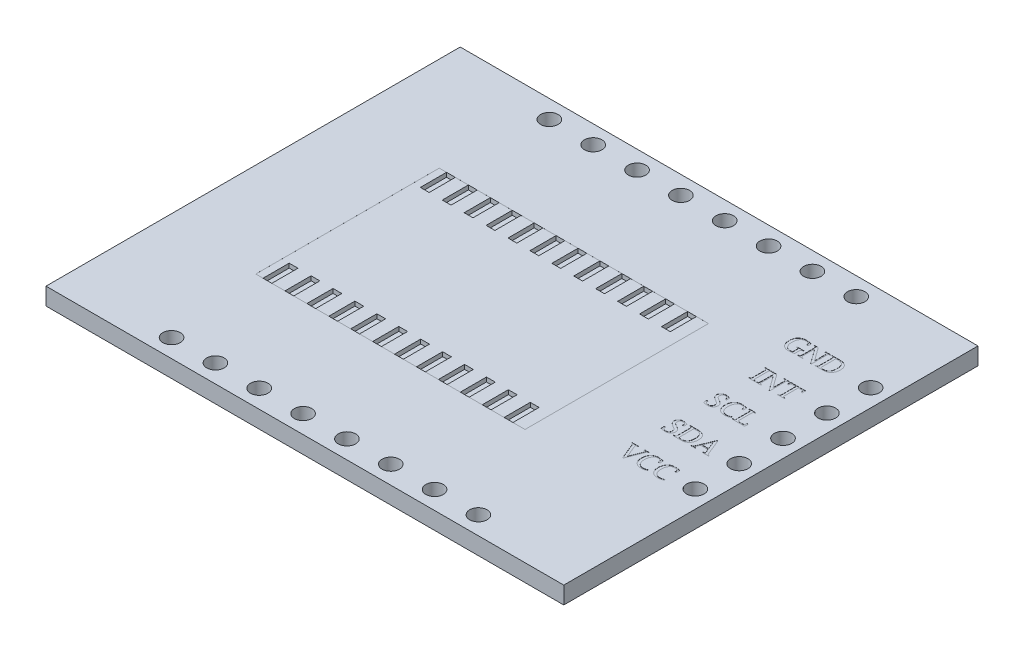
from build123d import *

# Parameters (mm, degrees)
SKETCH1_W           = 30
SKETCH1_H           = 24
BOSS_EXTRUDE1_DEPTH = 1
SKETCH2_W           = 15.6
SKETCH2_H           = 10.63
CUT_EXTRUDE1_DEPTH  = 0.001
SKETCH3_W           = 0.51
SKETCH3_H           = 1.515
CUT_EXTRUDE2_DEPTH  = 0.25
SKETCH4_R           = 0.505
CUT_EXTRUDE3_DEPTH  = 10.25
CUT_EXTRUDE4_DEPTH  = 0.01


with BuildPart() as part:
    # Sketch1 → Boss-Extrude1 (new body)
    with BuildSketch(Plane(origin=(0, 0, 0), x_dir=(1, 0, 0), z_dir=(0, 1, 0))):
        Rectangle(SKETCH1_W, SKETCH1_H)
    extrude(amount=BOSS_EXTRUDE1_DEPTH)

    # Sketch2 → Cut-Extrude1 (cut)
    with BuildSketch(Plane(origin=(0, 1, 0), x_dir=(1, 0, 0), z_dir=(0, 1, 0))):
        with Locations((-1.730631523, 0)):
            Rectangle(SKETCH2_W, SKETCH2_H)
    extrude(amount=-CUT_EXTRUDE1_DEPTH, mode=Mode.SUBTRACT)

    # Sketch3 → Cut-Extrude2 (cut)
    with BuildSketch(Plane(origin=(0, 0.999, 0), x_dir=(1, 0, 0), z_dir=(0, 1, 0))):
        with Locations((5.114368477, 4.5575)):
            Rectangle(SKETCH3_W, SKETCH3_H)
        with Locations((3.844368477, 4.5575)):
            Rectangle(SKETCH3_W, SKETCH3_H)
        with Locations((2.574368477, 4.5575)):
            Rectangle(SKETCH3_W, SKETCH3_H)
        with Locations((1.304368477, 4.5575)):
            Rectangle(SKETCH3_W, SKETCH3_H)
        with Locations((0.034368477, 4.5575)):
            Rectangle(SKETCH3_W, SKETCH3_H)
        with Locations((-1.235631523, 4.5575)):
            Rectangle(SKETCH3_W, SKETCH3_H)
        with Locations((-2.505631523, 4.5575)):
            Rectangle(SKETCH3_W, SKETCH3_H)
        with Locations((-3.775631523, 4.5575)):
            Rectangle(SKETCH3_W, SKETCH3_H)
        with Locations((-5.045631523, 4.5575)):
            Rectangle(SKETCH3_W, SKETCH3_H)
        with Locations((-6.315631523, 4.5575)):
            Rectangle(SKETCH3_W, SKETCH3_H)
        with Locations((-7.585631523, 4.5575)):
            Rectangle(SKETCH3_W, SKETCH3_H)
        with Locations((-8.855631523, 4.5575)):
            Rectangle(SKETCH3_W, SKETCH3_H)
        with Locations((5.114368477, -4.5575)):
            Rectangle(SKETCH3_W, SKETCH3_H)
        with Locations((3.844368477, -4.5575)):
            Rectangle(SKETCH3_W, SKETCH3_H)
        with Locations((2.574368477, -4.5575)):
            Rectangle(SKETCH3_W, SKETCH3_H)
        with Locations((1.304368477, -4.5575)):
            Rectangle(SKETCH3_W, SKETCH3_H)
        with Locations((0.034368477, -4.5575)):
            Rectangle(SKETCH3_W, SKETCH3_H)
        with Locations((-1.235631523, -4.5575)):
            Rectangle(SKETCH3_W, SKETCH3_H)
        with Locations((-2.505631523, -4.5575)):
            Rectangle(SKETCH3_W, SKETCH3_H)
        with Locations((-3.775631523, -4.5575)):
            Rectangle(SKETCH3_W, SKETCH3_H)
        with Locations((-5.045631523, -4.5575)):
            Rectangle(SKETCH3_W, SKETCH3_H)
        with Locations((-6.315631523, -4.5575)):
            Rectangle(SKETCH3_W, SKETCH3_H)
        with Locations((-7.585631523, -4.5575)):
            Rectangle(SKETCH3_W, SKETCH3_H)
        with Locations((-8.855631523, -4.5575)):
            Rectangle(SKETCH3_W, SKETCH3_H)
    extrude(amount=-CUT_EXTRUDE2_DEPTH, mode=Mode.SUBTRACT)

    # Sketch4 → Cut-Extrude3 (cut)
    with BuildSketch(Plane(origin=(0, 1, 0), x_dir=(1, 0, 0), z_dir=(0, 1, 0))):
        with Locations(Location((13.99, 6.792914833, 0), (0, 0, 270))):
            Circle(SKETCH4_R)
        with Locations(Location((13.99, 4.252914833, 0), (0, 0, 270))):
            Circle(SKETCH4_R)
        with Locations(Location((13.99, 1.712914833, 0), (0, 0, 270))):
            Circle(SKETCH4_R)
        with Locations(Location((13.99, -0.827085167, 0), (0, 0, 270))):
            Circle(SKETCH4_R)
        with Locations(Location((13.99, -3.367085167, 0), (0, 0, 270))):
            Circle(SKETCH4_R)
        with Locations(Location((-8.78, -10.945510681, 0), (0, 0, 270))):
            Circle(SKETCH4_R)
        with Locations(Location((-6.24, -10.945510681, 0), (0, 0, 270))):
            Circle(SKETCH4_R)
        with Locations(Location((-3.7, -10.945510681, 0), (0, 0, 270))):
            Circle(SKETCH4_R)
        with Locations(Location((-1.16, -10.945510681, 0), (0, 0, 270))):
            Circle(SKETCH4_R)
        with Locations(Location((1.38, -10.945510681, 0), (0, 0, 270))):
            Circle(SKETCH4_R)
        with Locations(Location((3.92, -10.945510681, 0), (0, 0, 270))):
            Circle(SKETCH4_R)
        with Locations(Location((6.46, -10.945510681, 0), (0, 0, 270))):
            Circle(SKETCH4_R)
        with Locations(Location((9, -10.945510681, 0), (0, 0, 270))):
            Circle(SKETCH4_R)
        with Locations(Location((9, 10.945510681, 0), (0, 0, 270))):
            Circle(SKETCH4_R)
        with Locations(Location((6.46, 10.945510681, 0), (0, 0, 270))):
            Circle(SKETCH4_R)
        with Locations(Location((3.92, 10.945510681, 0), (0, 0, 270))):
            Circle(SKETCH4_R)
        with Locations(Location((1.38, 10.945510681, 0), (0, 0, 270))):
            Circle(SKETCH4_R)
        with Locations(Location((-1.16, 10.945510681, 0), (0, 0, 270))):
            Circle(SKETCH4_R)
        with Locations(Location((-3.7, 10.945510681, 0), (0, 0, 270))):
            Circle(SKETCH4_R)
        with Locations(Location((-6.24, 10.945510681, 0), (0, 0, 270))):
            Circle(SKETCH4_R)
        with Locations(Location((-8.78, 10.945510681, 0), (0, 0, 270))):
            Circle(SKETCH4_R)
    extrude(amount=-CUT_EXTRUDE3_DEPTH, mode=Mode.SUBTRACT)

    # Sketch5 → Cut-Extrude4 (cut)
    # profile 1 of 15: a face of its own
    with BuildSketch(Plane(origin=(0, 1, 0), x_dir=(1, 0, 0), z_dir=(0, 1, 0))):
        with BuildLine():
            Line((11.259230769, 6.287914833), (11.259230769, 6.326376371))
            Line((11.259230769, 6.326376371), (11.272451923, 6.327177653))
            add(Edge.make_bspline(
                [(11.272451923, 6.327177653), (11.279066965, 6.327666177), (11.29164684, 6.328595206), (11.30941407, 6.33061483), (11.325107247, 6.33284318), (11.338551407, 6.335999864), (11.350064193, 6.338942184), (11.359281672, 6.342801597), (11.366607353, 6.346717759), (11.372166373, 6.351624589), (11.375893224, 6.358359813), (11.378998209, 6.366879173), (11.381760308, 6.377749514), (11.383878703, 6.391022413), (11.385382845, 6.406682259), (11.386557855, 6.424786537), (11.387391413, 6.445292405), (11.38742058, 6.459788917), (11.387435897, 6.467402012)],
                knots=[0, 0, 0, 0, 1.434223856, 2.727474356, 3.867048795, 4.858481374, 5.713375648, 6.432048766, 7.014145389, 7.504681859, 8.009876932, 8.658876013, 9.464418017, 10.430606696, 11.562838439, 12.865326848, 14.353772105, 16, 16, 16, 16], degree=3))
            Line((11.387435897, 6.467402012), (11.387435897, 7.108427653))
            add(Edge.make_bspline(
                [(11.387435897, 7.108427653), (11.387421364, 7.116107522), (11.387393803, 7.130670808), (11.386558207, 7.151243568), (11.385381914, 7.169347366), (11.383881478, 7.185008659), (11.381752198, 7.198277294), (11.379036252, 7.209099197), (11.375898113, 7.217476838), (11.372162977, 7.224035143), (11.36652965, 7.228680945), (11.359336801, 7.232683567), (11.350001548, 7.236195489), (11.338591914, 7.23932523), (11.325051383, 7.242037086), (11.309444889, 7.244725073), (11.291640818, 7.246600193), (11.27906489, 7.247551049), (11.272451923, 7.248051051)],
                knots=[0, 0, 0, 0, 1.663492872, 3.154470594, 4.459175079, 5.59333322, 6.561165788, 7.368078355, 8.00468548, 8.498392893, 8.980088247, 9.563175259, 10.277674215, 11.13402302, 12.124082947, 13.267885073, 14.563335932, 16, 16, 16, 16], degree=3))
            Line((11.272451923, 7.248051051), (11.259230769, 7.249453294))
            Line((11.259230769, 7.249453294), (11.259230769, 7.287914833))
            Line((11.259230769, 7.287914833), (11.580144231, 7.287914833))
            Line((11.580144231, 7.287914833), (11.685112179, 7.287914833))
            Line((11.685112179, 7.287914833), (11.733990385, 7.287914833))
            add(Edge.make_bspline(
                [(11.733990385, 7.287914833), (11.753036598, 7.287536689), (11.790152807, 7.286799784), (11.844074327, 7.280907625), (11.89466235, 7.271464684), (11.941747536, 7.257809739), (11.985489395, 7.240395468), (12.025835109, 7.21906594), (12.062902532, 7.193866479), (12.084709209, 7.17387311), (12.09556891, 7.163916435)],
                knots=[0, 0, 0, 0, 1.165348567, 2.270967033, 3.315247194, 4.311028358, 5.266396332, 6.191374364, 7.099306486, 8, 8, 8, 8], degree=3))
            add(Edge.make_bspline(
                [(12.09556891, 7.163916435), (12.105593717, 7.153262939), (12.125710515, 7.131884547), (12.151081652, 7.095357796), (12.172821138, 7.05576492), (12.19055559, 7.012700786), (12.204041433, 6.966190585), (12.213806236, 6.916390396), (12.2196552, 6.863174306), (12.220390464, 6.826591782), (12.220769231, 6.807746564)],
                knots=[0, 0, 0, 0, 0.904426216, 1.814913883, 2.743458883, 3.695978246, 4.691226048, 5.736044457, 6.83373997, 8, 8, 8, 8], degree=3))
            add(Edge.make_bspline(
                [(12.220769231, 6.807746564), (12.220394906, 6.788234272), (12.219663617, 6.7501147), (12.213673922, 6.694542343), (12.203370269, 6.642184253), (12.189499057, 6.592798809), (12.17119305, 6.546580552), (12.148952118, 6.503370383), (12.122301553, 6.463605218), (12.092106699, 6.427003735), (12.058196806, 6.394410921), (12.021405973, 6.365755525), (11.981595374, 6.341463124), (11.938719153, 6.321868377), (11.892982208, 6.306575425), (11.844362608, 6.295897164), (11.792877277, 6.289081809), (11.757516925, 6.288310193), (11.739399038, 6.287914833)],
                knots=[0, 0, 0, 0, 1.168483799, 2.282771438, 3.342408076, 4.361448227, 5.350669854, 6.314802771, 7.266504654, 8.212280706, 9.151310373, 10.077675765, 11.000200173, 11.937891795, 12.895265677, 13.882998656, 14.915293904, 16, 16, 16, 16], degree=3))
            Line((11.739399038, 6.287914833), (11.259230769, 6.287914833))
        make_face()
        with BuildLine():
            Line((11.528461538, 7.236632781), (11.528461538, 6.46660073))
            add(Edge.make_bspline(
                [(11.528461538, 6.46660073), (11.528441305, 6.459519472), (11.528403105, 6.44615001), (11.529666313, 6.427271026), (11.530516405, 6.410708418), (11.53269728, 6.396649781), (11.534774942, 6.38484482), (11.538156564, 6.375738057), (11.54118444, 6.36835753), (11.544580357, 6.36522751), (11.546089744, 6.363836307)],
                knots=[0, 0, 0, 0, 1.598794012, 3.018533594, 4.273630363, 5.340109403, 6.233408952, 6.967964537, 7.54129002, 8, 8, 8, 8], degree=3))
            add(Edge.make_bspline(
                [(11.546089744, 6.363836307), (11.54930937, 6.361800195), (11.556204462, 6.357439696), (11.568382369, 6.3526593), (11.582512154, 6.348412148), (11.598767833, 6.345191855), (11.616989026, 6.342267088), (11.637348879, 6.340680517), (11.65972135, 6.339378115), (11.675360788, 6.339258966), (11.683509615, 6.339196884)],
                knots=[0, 0, 0, 0, 0.645714541, 1.382850196, 2.211641814, 3.150239214, 4.194370606, 5.344304464, 6.616267181, 8, 8, 8, 8], degree=3))
            add(Edge.make_bspline(
                [(11.683509615, 6.339196884), (11.698482306, 6.339540988), (11.727587666, 6.34020989), (11.769789128, 6.345433114), (11.809098254, 6.354133637), (11.845421982, 6.366643222), (11.878978886, 6.38248408), (11.909673614, 6.401989932), (11.937287344, 6.425287552), (11.962146797, 6.451955823), (11.984085929, 6.482218985), (12.002904013, 6.516094763), (12.018732233, 6.553468121), (12.031681245, 6.59432744), (12.041869371, 6.638674568), (12.048896833, 6.686571068), (12.053420298, 6.737881026), (12.05387057, 6.773281283), (12.054102564, 6.791520602)],
                knots=[0, 0, 0, 0, 1.074143024, 2.088022843, 3.045838663, 3.958021492, 4.838873416, 5.702830866, 6.559864966, 7.424353706, 8.312783438, 9.235177587, 10.199026519, 11.220328839, 12.307061587, 13.460390229, 14.691513645, 16, 16, 16, 16], degree=3))
            add(Edge.make_bspline(
                [(12.054102564, 6.791520602), (12.053797986, 6.810493442), (12.053210386, 6.847096268), (12.048644048, 6.899985839), (12.040881627, 6.948793659), (12.030255082, 6.993639632), (12.016244935, 7.034413602), (11.999062111, 7.071081936), (11.978717587, 7.103672637), (11.95521529, 7.132432419), (11.928010321, 7.157357854), (11.896987101, 7.178669923), (11.862243494, 7.196834242), (11.823499584, 7.211306974), (11.781027365, 7.222685933), (11.734707686, 7.23075473), (11.684558509, 7.235850733), (11.649802024, 7.236366198), (11.631826923, 7.236632781)],
                knots=[0, 0, 0, 0, 1.279964521, 2.469335981, 3.578092386, 4.611771926, 5.574900928, 6.481764743, 7.33800028, 8.160566012, 8.980016889, 9.81856433, 10.693116763, 11.618512635, 12.603169642, 13.65568417, 14.787584145, 16, 16, 16, 16], degree=3))
            Line((11.631826923, 7.236632781), (11.528461538, 7.236632781))
        make_face(mode=Mode.SUBTRACT)
    # profile 2 of 15: a face of its own
    with BuildSketch(Plane(origin=(0, 1, 0), x_dir=(1, 0, 0), z_dir=(0, 1, 0))):
        with BuildLine():
            Line((11.039078526, 6.262273807), (10.425897436, 7.112233743))
            Line((10.425897436, 7.112233743), (10.425897436, 6.467402012))
            add(Edge.make_bspline(
                [(10.425897436, 6.467402012), (10.425911539, 6.459722132), (10.425938282, 6.445158827), (10.426782019, 6.424519614), (10.427947784, 6.406349039), (10.429434043, 6.390617933), (10.431632627, 6.377376229), (10.43413233, 6.366561755), (10.436996416, 6.358102157), (10.440785367, 6.351680035), (10.446232965, 6.346814047), (10.453582855, 6.343032013), (10.462970721, 6.339362637), (10.474579237, 6.336393116), (10.488228004, 6.333239085), (10.504133683, 6.331065952), (10.522146396, 6.328756112), (10.534932485, 6.327723044), (10.541682692, 6.327177653)],
                knots=[0, 0, 0, 0, 1.653481431, 3.135485965, 4.446684374, 5.574016783, 6.53602462, 7.334593987, 7.962285868, 8.453021989, 8.921121293, 9.513225282, 10.22342415, 11.088470441, 12.089648111, 13.238503892, 14.542113002, 16, 16, 16, 16], degree=3))
            Line((10.541682692, 6.327177653), (10.554102564, 6.326376371))
            Line((10.554102564, 6.326376371), (10.554102564, 6.287914833))
            Line((10.554102564, 6.287914833), (10.233589744, 6.287914833))
            Line((10.233589744, 6.287914833), (10.233589744, 6.326376371))
            Line((10.233589744, 6.326376371), (10.246009615, 6.327177653))
            add(Edge.make_bspline(
                [(10.246009615, 6.327177653), (10.252759608, 6.327723962), (10.26554529, 6.328758768), (10.283560703, 6.331057079), (10.299522526, 6.333275511), (10.313196763, 6.336326319), (10.324777382, 6.339401934), (10.334110307, 6.343028791), (10.341459181, 6.346814657), (10.346906982, 6.351679881), (10.350695877, 6.358102212), (10.353559983, 6.366561734), (10.356059678, 6.377376237), (10.358258266, 6.39061793), (10.359744523, 6.40634904), (10.360910289, 6.424519614), (10.361754026, 6.445158827), (10.361780769, 6.459722132), (10.361794872, 6.467402012)],
                knots=[0, 0, 0, 0, 1.457869368, 2.761462715, 3.910304604, 4.925514747, 5.776699474, 6.486889755, 7.078986584, 7.547080227, 8.037810414, 8.665494705, 9.464054416, 10.42605062, 11.553369397, 12.86455195, 14.346538563, 16, 16, 16, 16], degree=3))
            Line((10.361794872, 6.467402012), (10.361794872, 7.108427653))
            add(Edge.make_bspline(
                [(10.361794872, 7.108427653), (10.361780708, 7.116174265), (10.36175396, 7.130804262), (10.360921498, 7.15144431), (10.35972343, 7.169612684), (10.358266906, 7.185345166), (10.356091918, 7.198594842), (10.353528459, 7.2093276), (10.350696852, 7.217726026), (10.346909489, 7.22415507), (10.34149168, 7.228954549), (10.334280183, 7.232865929), (10.324967349, 7.236402897), (10.313486645, 7.239536807), (10.29982917, 7.242290264), (10.284044895, 7.244627046), (10.266072514, 7.246648112), (10.253358905, 7.247564589), (10.246610577, 7.248051051)],
                knots=[0, 0, 0, 0, 1.672685478, 3.158979153, 4.459584784, 5.604524725, 6.569316755, 7.356185884, 7.985694398, 8.477850782, 8.947304835, 9.528560024, 10.240814313, 11.094472818, 12.095541049, 13.247721789, 14.539102866, 16, 16, 16, 16], degree=3))
            Line((10.246610577, 7.248051051), (10.233589744, 7.249453294))
            Line((10.233589744, 7.249453294), (10.233589744, 7.287914833))
            Line((10.233589744, 7.287914833), (10.455344551, 7.287914833))
            Line((10.455344551, 7.287914833), (11.015641026, 6.511472525))
            Line((11.015641026, 6.511472525), (11.015641026, 7.108427653))
            add(Edge.make_bspline(
                [(11.015641026, 7.108427653), (11.015626492, 7.116107522), (11.015598931, 7.130670807), (11.014763335, 7.15124357), (11.01358704, 7.169347362), (11.012086611, 7.185008674), (11.009957311, 7.198277252), (11.007241424, 7.209099315), (11.004103126, 7.217476531), (11.000368428, 7.224036005), (10.99473349, 7.228677508), (10.987493995, 7.232731506), (10.97805344, 7.236144054), (10.966540179, 7.239364919), (10.952915077, 7.242003268), (10.937186177, 7.244748339), (10.919243662, 7.246594024), (10.906535135, 7.247549087), (10.899855769, 7.248051051)],
                knots=[0, 0, 0, 0, 1.657644955, 3.143381228, 4.443499096, 5.573670167, 6.538100373, 7.342176284, 7.976545452, 8.468517264, 8.948519245, 9.529556447, 10.254985345, 11.108323703, 12.109016506, 13.248797659, 14.554019051, 16, 16, 16, 16], degree=3))
            Line((10.899855769, 7.248051051), (10.887435897, 7.249453294))
            Line((10.887435897, 7.249453294), (10.887435897, 7.287914833))
            Line((10.887435897, 7.287914833), (11.207948718, 7.287914833))
            Line((11.207948718, 7.287914833), (11.207948718, 7.249453294))
            Line((11.207948718, 7.249453294), (11.194727564, 7.248051051))
            add(Edge.make_bspline(
                [(11.194727564, 7.248051051), (11.188047363, 7.247554672), (11.175403426, 7.246615152), (11.157471738, 7.244701792), (11.141788935, 7.242061856), (11.128192016, 7.239316103), (11.116763107, 7.236217027), (11.107427742, 7.232602665), (11.100079359, 7.228814288), (11.094631459, 7.223949565), (11.090842597, 7.217527097), (11.087978446, 7.209067626), (11.085478938, 7.198253093), (11.083279446, 7.185011467), (11.081803737, 7.169346434), (11.08061927, 7.151243872), (11.079786286, 7.130670717), (11.079758332, 7.116107491), (11.07974359, 7.108427653)],
                knots=[0, 0, 0, 0, 1.449098173, 2.742777841, 3.89926685, 4.887973129, 5.743151102, 6.456673167, 7.051547757, 7.521837414, 8.014869811, 8.645498818, 9.447804889, 10.4143142, 11.546921676, 12.849842319, 14.338781519, 16, 16, 16, 16], degree=3))
            Line((11.07974359, 7.108427653), (11.07974359, 6.262273807))
            Line((11.07974359, 6.262273807), (11.039078526, 6.262273807))
        make_face()
    # profile 3 of 15: a face of its own
    with BuildSketch(Plane(origin=(0, 1, 0), x_dir=(1, 0, 0), z_dir=(0, 1, 0))):
        with BuildLine():
            add(Edge.make_bspline(
                [(10.066923077, 6.31035073), (10.051245074, 6.30655335), (10.020622831, 6.299136314), (9.975501354, 6.289237548), (9.932195892, 6.281074537), (9.890806669, 6.274162756), (9.851243607, 6.268988421), (9.813579225, 6.265083803), (9.777754715, 6.262830406), (9.754492624, 6.26245565), (9.743205128, 6.262273807)],
                knots=[0, 0, 0, 0, 1.180213686, 2.305190879, 3.379277064, 4.404103446, 5.37487123, 6.298003223, 7.174137776, 8, 8, 8, 8], degree=3))
            add(Edge.make_bspline(
                [(9.743205128, 6.262273807), (9.725218007, 6.26265263), (9.689977138, 6.26339483), (9.638644524, 6.270500387), (9.589929628, 6.28122124), (9.544310433, 6.297300552), (9.50125106, 6.317282134), (9.461200334, 6.342144796), (9.423920057, 6.371367343), (9.389722148, 6.404863851), (9.358850505, 6.442044203), (9.332128468, 6.482731497), (9.309567942, 6.526535122), (9.291224263, 6.573355453), (9.276657304, 6.623142701), (9.266673103, 6.676014192), (9.260240219, 6.731933088), (9.259572853, 6.770268045), (9.259230769, 6.789918038)],
                knots=[0, 0, 0, 0, 1.067437982, 2.09135424, 3.071452224, 4.024421176, 4.95737663, 5.884932957, 6.81688531, 7.764560868, 8.721989777, 9.680903461, 10.649116433, 11.642334965, 12.662413479, 13.724595733, 14.833657835, 16, 16, 16, 16], degree=3))
            add(Edge.make_bspline(
                [(9.259230769, 6.789918038), (9.259593375, 6.810165892), (9.260298743, 6.84955356), (9.266388457, 6.906826947), (9.276348737, 6.960637803), (9.290223425, 7.010995676), (9.308352683, 7.057835344), (9.330381563, 7.101151915), (9.35662308, 7.140904253), (9.386672803, 7.177034213), (9.420461688, 7.209273898), (9.457736644, 7.237142557), (9.498115323, 7.261143248), (9.542022547, 7.280184162), (9.589021848, 7.295394774), (9.639336854, 7.305779639), (9.692818045, 7.312340856), (9.72956335, 7.313143901), (9.748413462, 7.313555858)],
                knots=[0, 0, 0, 0, 1.192704681, 2.320139893, 3.388824897, 4.413985691, 5.392987297, 6.343113459, 7.271687599, 8.193494755, 9.106223837, 10.016592751, 10.930169322, 11.867296577, 12.830278336, 13.8356819, 14.889718352, 16, 16, 16, 16], degree=3))
            add(Edge.make_bspline(
                [(9.748413462, 7.313555858), (9.762172323, 7.313402882), (9.789577446, 7.313098181), (9.830408716, 7.31061677), (9.870841887, 7.306633835), (9.910844862, 7.300939905), (9.950596875, 7.294085205), (9.989761421, 7.285110353), (10.028672798, 7.275049592), (10.054140533, 7.266809995), (10.066923077, 7.262674448)],
                knots=[0, 0, 0, 0, 1.019323362, 2.030304715, 3.029610275, 4.02870763, 5.023447213, 6.017239067, 7.00482993, 8, 8, 8, 8], degree=3))
            Line((10.066923077, 7.262674448), (10.066923077, 7.082786628))
            Line((10.066923077, 7.082786628), (9.99, 7.082786628))
            Line((9.99, 7.082786628), (9.99, 7.09560714))
            add(Edge.make_bspline(
                [(9.99, 7.09560714), (9.99, 7.101616756), (9.99, 7.113903081), (9.99, 7.126189405), (9.99, 7.132466115)],
                knots=[0, 0, 0, 0, 0.97826087, 2, 2, 2, 2], degree=3))
            add(Edge.make_bspline(
                [(9.99, 7.132466115), (9.989809051, 7.137423172), (9.989436841, 7.147085802), (9.986467992, 7.161152237), (9.981981587, 7.174464101), (9.975145152, 7.186894245), (9.966536631, 7.198436566), (9.956141043, 7.20924838), (9.943786242, 7.21908568), (9.929525089, 7.227974142), (9.913769165, 7.236201363), (9.896401592, 7.24325714), (9.877491257, 7.248888147), (9.857280601, 7.254004907), (9.835517287, 7.257773032), (9.812296046, 7.260270491), (9.787566091, 7.261917245), (9.77058504, 7.262152555), (9.761834936, 7.262273807)],
                knots=[0, 0, 0, 0, 0.814575539, 1.587825669, 2.355439562, 3.117138027, 3.910103731, 4.717913637, 5.577238159, 6.500441481, 7.477966679, 8.497706466, 9.578097354, 10.720829787, 11.925180807, 13.207153568, 14.560884371, 16, 16, 16, 16], degree=3))
            add(Edge.make_bspline(
                [(9.761834936, 7.262273807), (9.748724344, 7.261897139), (9.723170106, 7.261162965), (9.686070813, 7.255220044), (9.651251012, 7.24566221), (9.618702757, 7.231947637), (9.588565799, 7.214168738), (9.560571281, 7.192785401), (9.535198292, 7.167203368), (9.512243086, 7.137907438), (9.491719491, 7.105092316), (9.474144228, 7.068761061), (9.459159534, 7.029272689), (9.446993446, 6.986494217), (9.437386842, 6.940511424), (9.430708465, 6.891175877), (9.426697794, 6.838596028), (9.426169215, 6.802478771), (9.425897436, 6.783908423)],
                knots=[0, 0, 0, 0, 0.952972586, 1.857466776, 2.724575308, 3.573227785, 4.417688466, 5.262651587, 6.127909065, 7.030367632, 7.964056463, 8.936960803, 9.960530745, 11.03172487, 12.167865389, 13.373744674, 14.649662751, 16, 16, 16, 16], degree=3))
            add(Edge.make_bspline(
                [(9.425897436, 6.783908423), (9.426226254, 6.766471903), (9.426866083, 6.732543119), (9.43120831, 6.683125217), (9.438793281, 6.636654258), (9.44944126, 6.593075549), (9.462690287, 6.552200968), (9.479386132, 6.514373211), (9.49912195, 6.479483429), (9.521681645, 6.447547127), (9.547137716, 6.419105441), (9.574935925, 6.394181125), (9.605176382, 6.373230083), (9.63775825, 6.356106795), (9.672588871, 6.342505015), (9.709912131, 6.333338124), (9.749413442, 6.327218569), (9.776567545, 6.3266617), (9.790480769, 6.326376371)],
                knots=[0, 0, 0, 0, 1.265497258, 2.462462952, 3.597021408, 4.679597309, 5.715610733, 6.711572695, 7.675172431, 8.62052567, 9.543794599, 10.439692129, 11.324284547, 12.206617195, 13.105720514, 14.030781176, 14.99101133, 16, 16, 16, 16], degree=3))
            add(Edge.make_bspline(
                [(9.790480769, 6.326376371), (9.799904767, 6.326715056), (9.820084554, 6.327440287), (9.852152653, 6.331431049), (9.887870568, 6.338205885), (9.912766042, 6.344100516), (9.925897436, 6.347209705)],
                knots=[0, 0, 0, 0, 0.823884314, 1.764199162, 2.82070204, 4, 4, 4, 4], degree=3))
            Line((9.925897436, 6.347209705), (9.925897436, 6.531504576))
            add(Edge.make_bspline(
                [(9.925897436, 6.531504576), (9.925883273, 6.539251189), (9.925856526, 6.553881188), (9.925024057, 6.574521224), (9.92382601, 6.592689638), (9.92236942, 6.608421997), (9.920194627, 6.621672028), (9.917630627, 6.632403801), (9.914800474, 6.640804875), (9.911009087, 6.647226595), (9.905561901, 6.652091969), (9.898212816, 6.655877784), (9.888879966, 6.659504659), (9.87729932, 6.662580268), (9.863625093, 6.665631078), (9.847663266, 6.667849509), (9.829647854, 6.67014782), (9.816862172, 6.671182626), (9.810112179, 6.671728935)],
                knots=[0, 0, 0, 0, 1.667800396, 3.149753347, 4.446560557, 5.588156697, 6.55013105, 7.334702126, 7.962372159, 8.453091199, 8.921174211, 9.513257591, 10.22343174, 11.074597133, 12.089784216, 13.238600009, 14.542163746, 16, 16, 16, 16], degree=3))
            Line((9.810112179, 6.671728935), (9.797692308, 6.672530217))
            Line((9.797692308, 6.672530217), (9.797692308, 6.710991756))
            Line((9.797692308, 6.710991756), (10.195128205, 6.710991756))
            Line((10.195128205, 6.710991756), (10.195128205, 6.672530217))
            Line((10.195128205, 6.672530217), (10.182708333, 6.671728935))
            add(Edge.make_bspline(
                [(10.182708333, 6.671728935), (10.175958125, 6.671183544), (10.163172037, 6.670150477), (10.145159324, 6.667840637), (10.129253642, 6.665667504), (10.115604884, 6.662513471), (10.103996342, 6.659543957), (10.094608551, 6.655874562), (10.08725845, 6.65209258), (10.081811466, 6.647226442), (10.078020024, 6.64080493), (10.075189892, 6.63240378), (10.072625884, 6.621672036), (10.070451094, 6.608421995), (10.068994502, 6.592689638), (10.067796456, 6.574521223), (10.066963987, 6.553881188), (10.06693724, 6.539251189), (10.066923077, 6.531504576)],
                knots=[0, 0, 0, 0, 1.457853882, 2.761433382, 3.910263067, 4.911417996, 5.776444637, 6.486627374, 7.078717913, 7.546806585, 8.037531559, 8.665209182, 9.449789744, 10.41177573, 11.553385675, 12.850208566, 14.332179437, 16, 16, 16, 16], degree=3))
            Line((10.066923077, 6.531504576), (10.066923077, 6.31035073))
        make_face()
    # profile 4 of 15: a face of its own
    with BuildSketch(Plane(origin=(0, 1, 0), x_dir=(1, 0, 0), z_dir=(0, 1, 0))):
        with BuildLine():
            Line((11.759230769, 4.683812269), (11.605384615, 4.683812269))
            add(Edge.make_bspline(
                [(11.605384615, 4.683812269), (11.596303003, 4.683716203), (11.578735116, 4.683530369), (11.553200454, 4.682648438), (11.52948519, 4.680626978), (11.514300174, 4.678717301), (11.507027244, 4.677802653)],
                knots=[0, 0, 0, 0, 1.105125493, 2.137805508, 3.108093649, 4, 4, 4, 4], degree=3))
            add(Edge.make_bspline(
                [(11.507027244, 4.677802653), (11.504781791, 4.677391981), (11.500435779, 4.676597137), (11.494680719, 4.673354945), (11.489668002, 4.669108974), (11.485919665, 4.663263188), (11.482864037, 4.656307672), (11.480778437, 4.648050182), (11.479307461, 4.638525084), (11.479226024, 4.631735736), (11.479182692, 4.628123166)],
                knots=[0, 0, 0, 0, 0.868946965, 1.681822776, 2.497914726, 3.363841884, 4.314830803, 5.401146389, 6.617166019, 8, 8, 8, 8], degree=3))
            add(Edge.make_bspline(
                [(11.479182692, 4.628123166), (11.479118265, 4.617504474), (11.478998696, 4.597797709), (11.478164945, 4.578108562), (11.477780449, 4.569028615)],
                knots=[0, 0, 0, 0, 1.077669777, 2, 2, 2, 2], degree=3))
            Line((11.477780449, 4.569028615), (11.477179487, 4.55560714))
            Line((11.477179487, 4.55560714), (11.40025641, 4.55560714))
            Line((11.40025641, 4.55560714), (11.40025641, 4.747914833))
            Line((11.40025641, 4.747914833), (12.259230769, 4.747914833))
            Line((12.259230769, 4.747914833), (12.259230769, 4.55560714))
            Line((12.259230769, 4.55560714), (12.182307692, 4.55560714))
            Line((12.182307692, 4.55560714), (12.181706731, 4.569028615))
            add(Edge.make_bspline(
                [(12.181706731, 4.569028615), (12.181157882, 4.578107204), (12.179968163, 4.597786541), (12.179926363, 4.617502625), (12.179903846, 4.628123166)],
                knots=[0, 0, 0, 0, 0.922652025, 2, 2, 2, 2], degree=3))
            add(Edge.make_bspline(
                [(12.179903846, 4.628123166), (12.179810011, 4.631729209), (12.179634099, 4.638489393), (12.178791791, 4.648061738), (12.176740047, 4.656236139), (12.174201935, 4.663250938), (12.170813775, 4.668917188), (12.16665372, 4.673403867), (12.161583224, 4.676498363), (12.157770583, 4.677368061), (12.155865385, 4.677802653)],
                knots=[0, 0, 0, 0, 1.441292118, 2.701964302, 3.827586232, 4.798472872, 5.672169073, 6.445665984, 7.223290688, 8, 8, 8, 8], degree=3))
            add(Edge.make_bspline(
                [(12.155865385, 4.677802653), (12.149194101, 4.678719191), (12.135149742, 4.680648683), (12.112834031, 4.682678647), (12.08823066, 4.683530673), (12.071063366, 4.683715784), (12.062115385, 4.683812269)],
                knots=[0, 0, 0, 0, 0.859308451, 1.809012391, 2.858007832, 4, 4, 4, 4], degree=3))
            Line((12.062115385, 4.683812269), (11.90025641, 4.683812269))
            Line((11.90025641, 4.683812269), (11.90025641, 3.927402012))
            add(Edge.make_bspline(
                [(11.90025641, 3.927402012), (11.900261939, 3.91985522), (11.900272413, 3.905558041), (11.901224371, 3.885262321), (11.902065086, 3.867279477), (11.903570786, 3.851611709), (11.905898279, 3.838353367), (11.908054679, 3.827271371), (11.911031057, 3.818594898), (11.91449706, 3.811716071), (11.919637414, 3.806588056), (11.926145503, 3.802171831), (11.934537641, 3.798475897), (11.944574972, 3.79506239), (11.956459258, 3.792325555), (11.970127173, 3.790216823), (11.985563538, 3.788406622), (11.996473072, 3.787601659), (12.002219551, 3.787177653)],
                knots=[0, 0, 0, 0, 1.721747236, 3.261800149, 4.63516406, 5.829814576, 6.849268245, 7.706967564, 8.400837902, 8.939515546, 9.445987131, 10.037650411, 10.726147035, 11.530780707, 12.454671759, 13.504194985, 14.685361651, 16, 16, 16, 16], degree=3))
            Line((12.002219551, 3.787177653), (12.028461538, 3.786376371))
            Line((12.028461538, 3.786376371), (12.028461538, 3.747914833))
            Line((12.028461538, 3.747914833), (11.631025641, 3.747914833))
            Line((11.631025641, 3.747914833), (11.631025641, 3.786376371))
            Line((11.631025641, 3.786376371), (11.657467949, 3.787177653))
            add(Edge.make_bspline(
                [(11.657467949, 3.787177653), (11.663214007, 3.787605064), (11.674188891, 3.788421412), (11.689696176, 3.790199778), (11.703427277, 3.792328593), (11.71531634, 3.795057078), (11.725339735, 3.798491077), (11.733722759, 3.802105184), (11.74007115, 3.806653421), (11.745194905, 3.811709098), (11.748656678, 3.818597115), (11.751622537, 3.827272231), (11.753842305, 3.83833424), (11.755847211, 3.851634886), (11.757375195, 3.867283282), (11.758600103, 3.885250104), (11.759114284, 3.905564158), (11.759190521, 3.919856534), (11.759230769, 3.927402012)],
                knots=[0, 0, 0, 0, 1.314584824, 2.510837174, 3.56031767, 4.484171106, 5.288772019, 5.97724061, 6.556389445, 7.06284041, 7.601496122, 8.295338209, 9.153002607, 10.170021111, 11.364622988, 12.738860292, 14.278322864, 16, 16, 16, 16], degree=3))
            Line((11.759230769, 3.927402012), (11.759230769, 4.683812269))
        make_face()
    # profile 5 of 15: a face of its own
    with BuildSketch(Plane(origin=(0, 1, 0), x_dir=(1, 0, 0), z_dir=(0, 1, 0))):
        with BuildLine():
            Line((11.180104167, 3.722273807), (10.566923077, 4.572233743))
            Line((10.566923077, 4.572233743), (10.566923077, 3.927402012))
            add(Edge.make_bspline(
                [(10.566923077, 3.927402012), (10.56693718, 3.919722132), (10.566963923, 3.905158827), (10.56780766, 3.884519614), (10.568973425, 3.866349039), (10.570459684, 3.850617933), (10.572658268, 3.837376229), (10.575157971, 3.826561755), (10.578022057, 3.818102157), (10.581811008, 3.811680035), (10.587258606, 3.806814047), (10.594608496, 3.803032013), (10.603996362, 3.799362637), (10.615604878, 3.796393116), (10.629253645, 3.793239085), (10.645159324, 3.791065952), (10.663172037, 3.788756112), (10.675958126, 3.787723044), (10.682708333, 3.787177653)],
                knots=[0, 0, 0, 0, 1.653481431, 3.135485965, 4.446684374, 5.574016783, 6.53602462, 7.334593987, 7.962285868, 8.453021989, 8.921121293, 9.513225282, 10.22342415, 11.088470441, 12.089648111, 13.238503892, 14.542113002, 16, 16, 16, 16], degree=3))
            Line((10.682708333, 3.787177653), (10.695128205, 3.786376371))
            Line((10.695128205, 3.786376371), (10.695128205, 3.747914833))
            Line((10.695128205, 3.747914833), (10.374615385, 3.747914833))
            Line((10.374615385, 3.747914833), (10.374615385, 3.786376371))
            Line((10.374615385, 3.786376371), (10.387035256, 3.787177653))
            add(Edge.make_bspline(
                [(10.387035256, 3.787177653), (10.393785249, 3.787723962), (10.406570931, 3.788758768), (10.424586344, 3.791057079), (10.440548167, 3.793275511), (10.454222404, 3.796326319), (10.465803023, 3.799401934), (10.475135948, 3.803028791), (10.482484822, 3.806814657), (10.487932623, 3.811679881), (10.491721518, 3.818102212), (10.494585625, 3.826561734), (10.497085319, 3.837376237), (10.499283907, 3.85061793), (10.500770164, 3.86634904), (10.50193593, 3.884519614), (10.502779667, 3.905158827), (10.50280641, 3.919722132), (10.502820513, 3.927402012)],
                knots=[0, 0, 0, 0, 1.457869368, 2.761462715, 3.910304604, 4.925514747, 5.776699474, 6.486889755, 7.078986584, 7.547080227, 8.037810414, 8.665494705, 9.464054416, 10.42605062, 11.553369397, 12.86455195, 14.346538563, 16, 16, 16, 16], degree=3))
            Line((10.502820513, 3.927402012), (10.502820513, 4.568427653))
            add(Edge.make_bspline(
                [(10.502820513, 4.568427653), (10.502806349, 4.576174265), (10.502779601, 4.590804262), (10.501947139, 4.61144431), (10.500749071, 4.629612684), (10.499292547, 4.645345166), (10.497117559, 4.658594842), (10.4945541, 4.6693276), (10.491722493, 4.677726026), (10.48793513, 4.68415507), (10.482517321, 4.688954549), (10.475305824, 4.692865929), (10.46599299, 4.696402897), (10.454512286, 4.699536807), (10.440854811, 4.702290264), (10.425070536, 4.704627046), (10.407098155, 4.706648112), (10.394384546, 4.707564589), (10.387636218, 4.708051051)],
                knots=[0, 0, 0, 0, 1.672685478, 3.158979153, 4.459584784, 5.604524725, 6.569316755, 7.356185884, 7.985694398, 8.477850782, 8.947304835, 9.528560024, 10.240814313, 11.094472818, 12.095541049, 13.247721789, 14.539102866, 16, 16, 16, 16], degree=3))
            Line((10.387636218, 4.708051051), (10.374615385, 4.709453294))
            Line((10.374615385, 4.709453294), (10.374615385, 4.747914833))
            Line((10.374615385, 4.747914833), (10.596370192, 4.747914833))
            Line((10.596370192, 4.747914833), (11.156666667, 3.971472525))
            Line((11.156666667, 3.971472525), (11.156666667, 4.568427653))
            add(Edge.make_bspline(
                [(11.156666667, 4.568427653), (11.156652133, 4.576107522), (11.156624572, 4.590670807), (11.155788977, 4.61124357), (11.154612681, 4.629347362), (11.153112252, 4.645008674), (11.150982952, 4.658277252), (11.148267065, 4.669099315), (11.145128767, 4.677476531), (11.141394069, 4.684036005), (11.135759131, 4.688677508), (11.128519636, 4.692731506), (11.119079081, 4.696144054), (11.10756582, 4.699364919), (11.093940718, 4.702003268), (11.078211818, 4.704748339), (11.060269303, 4.706594024), (11.047560776, 4.707549087), (11.04088141, 4.708051051)],
                knots=[0, 0, 0, 0, 1.657644955, 3.143381228, 4.443499096, 5.573670167, 6.538100373, 7.342176284, 7.976545452, 8.468517264, 8.948519245, 9.529556447, 10.254985345, 11.108323703, 12.109016506, 13.248797659, 14.554019051, 16, 16, 16, 16], degree=3))
            Line((11.04088141, 4.708051051), (11.028461538, 4.709453294))
            Line((11.028461538, 4.709453294), (11.028461538, 4.747914833))
            Line((11.028461538, 4.747914833), (11.348974359, 4.747914833))
            Line((11.348974359, 4.747914833), (11.348974359, 4.709453294))
            Line((11.348974359, 4.709453294), (11.335753205, 4.708051051))
            add(Edge.make_bspline(
                [(11.335753205, 4.708051051), (11.329073004, 4.707554672), (11.316429067, 4.706615152), (11.298497379, 4.704701792), (11.282814576, 4.702061856), (11.269217657, 4.699316103), (11.257788748, 4.696217027), (11.248453383, 4.692602665), (11.241105, 4.688814288), (11.2356571, 4.683949565), (11.231868238, 4.677527097), (11.229004087, 4.669067626), (11.226504579, 4.658253093), (11.224305087, 4.645011467), (11.222829378, 4.629346434), (11.221644911, 4.611243872), (11.220811927, 4.590670717), (11.220783973, 4.576107491), (11.220769231, 4.568427653)],
                knots=[0, 0, 0, 0, 1.449098173, 2.742777841, 3.89926685, 4.887973129, 5.743151102, 6.456673167, 7.051547757, 7.521837414, 8.014869811, 8.645498818, 9.447804889, 10.4143142, 11.546921676, 12.849842319, 14.338781519, 16, 16, 16, 16], degree=3))
            Line((11.220769231, 4.568427653), (11.220769231, 3.722273807))
            Line((11.220769231, 3.722273807), (11.180104167, 3.722273807))
        make_face()
    # profile 6 of 15: a face of its own
    with BuildSketch(Plane(origin=(0, 1, 0), x_dir=(1, 0, 0), z_dir=(0, 1, 0))):
        with BuildLine():
            Line((10.323333333, 3.786376371), (10.323333333, 3.747914833))
            Line((10.323333333, 3.747914833), (9.925897436, 3.747914833))
            Line((9.925897436, 3.747914833), (9.925897436, 3.786376371))
            Line((9.925897436, 3.786376371), (9.93911859, 3.787177653))
            add(Edge.make_bspline(
                [(9.93911859, 3.787177653), (9.945733632, 3.787666177), (9.958313507, 3.788595206), (9.976080737, 3.79061483), (9.991773914, 3.79284318), (10.005218073, 3.795999864), (10.016730859, 3.798942184), (10.025948338, 3.802801597), (10.033274019, 3.806717759), (10.03883304, 3.811624589), (10.042559891, 3.818359813), (10.045664876, 3.826879173), (10.048426975, 3.837749514), (10.05054537, 3.851022413), (10.052049512, 3.866682259), (10.053224522, 3.884786537), (10.054058079, 3.905292405), (10.054087246, 3.919788917), (10.054102564, 3.927402012)],
                knots=[0, 0, 0, 0, 1.434223856, 2.727474356, 3.867048795, 4.858481374, 5.713375648, 6.432048766, 7.014145389, 7.504681859, 8.009876932, 8.658876013, 9.464418017, 10.430606696, 11.562838439, 12.865326848, 14.353772105, 16, 16, 16, 16], degree=3))
            Line((10.054102564, 3.927402012), (10.054102564, 4.568427653))
            add(Edge.make_bspline(
                [(10.054102564, 4.568427653), (10.05408803, 4.576107522), (10.05406047, 4.590670808), (10.053224873, 4.611243568), (10.05204858, 4.629347366), (10.050548144, 4.645008659), (10.048418865, 4.658277294), (10.045702919, 4.669099197), (10.04256478, 4.677476838), (10.038829643, 4.684035143), (10.033196317, 4.688680945), (10.026003468, 4.692683567), (10.016668215, 4.696195489), (10.00525858, 4.69932523), (9.99171805, 4.702037086), (9.976111556, 4.704725073), (9.958307485, 4.706600193), (9.945731556, 4.707551049), (9.93911859, 4.708051051)],
                knots=[0, 0, 0, 0, 1.663492872, 3.154470594, 4.459175079, 5.59333322, 6.561165788, 7.368078355, 8.00468548, 8.498392893, 8.980088247, 9.563175259, 10.277674215, 11.13402302, 12.124082947, 13.267885073, 14.563335932, 16, 16, 16, 16], degree=3))
            Line((9.93911859, 4.708051051), (9.925897436, 4.709453294))
            Line((9.925897436, 4.709453294), (9.925897436, 4.747914833))
            Line((9.925897436, 4.747914833), (10.323333333, 4.747914833))
            Line((10.323333333, 4.747914833), (10.323333333, 4.709453294))
            Line((10.323333333, 4.709453294), (10.310112179, 4.708051051))
            add(Edge.make_bspline(
                [(10.310112179, 4.708051051), (10.303431979, 4.707554672), (10.290788041, 4.706615152), (10.272856353, 4.704701792), (10.25717355, 4.702061856), (10.243576631, 4.699316103), (10.232147723, 4.696217027), (10.222812357, 4.692602665), (10.215463974, 4.688814288), (10.210016074, 4.683949565), (10.206227212, 4.677527097), (10.203363062, 4.669067626), (10.200863553, 4.658253093), (10.198664061, 4.645011467), (10.197188352, 4.629346434), (10.196003885, 4.611243872), (10.195170902, 4.590670717), (10.195142947, 4.576107491), (10.195128205, 4.568427653)],
                knots=[0, 0, 0, 0, 1.449098173, 2.742777841, 3.89926685, 4.887973129, 5.743151102, 6.456673167, 7.051547757, 7.521837414, 8.014869811, 8.645498818, 9.447804889, 10.4143142, 11.546921676, 12.849842319, 14.338781519, 16, 16, 16, 16], degree=3))
            Line((10.195128205, 4.568427653), (10.195128205, 3.927402012))
            add(Edge.make_bspline(
                [(10.195128205, 3.927402012), (10.19514373, 3.91978895), (10.195173291, 3.9052925), (10.19600422, 3.884786214), (10.19718747, 3.866683248), (10.198666687, 3.851019433), (10.200855889, 3.837774226), (10.203398668, 3.826908599), (10.206230676, 3.81830996), (10.210015778, 3.811710137), (10.21538337, 3.806584526), (10.222868691, 3.802883943), (10.232085041, 3.79892101), (10.243617075, 3.796008575), (10.257117735, 3.792817791), (10.272886755, 3.79063729), (10.290782064, 3.788580265), (10.303429912, 3.787662525), (10.310112179, 3.787177653)],
                knots=[0, 0, 0, 0, 1.643944883, 3.130325943, 4.431008042, 5.56166959, 6.526518345, 7.327445978, 7.970552753, 8.475047214, 8.954390702, 9.548243241, 10.265919693, 11.119628387, 12.109686034, 13.261934515, 14.553391517, 16, 16, 16, 16], degree=3))
            Line((10.310112179, 3.787177653), (10.323333333, 3.786376371))
        make_face()
    # profile 7 of 15: a face of its own
    with BuildSketch(Plane(origin=(0, 1, 0), x_dir=(1, 0, 0), z_dir=(0, 1, 0))):
        with BuildLine():
            Line((12.272051282, 1.207914833), (11.541282051, 1.207914833))
            Line((11.541282051, 1.207914833), (11.541282051, 1.246376371))
            Line((11.541282051, 1.246376371), (11.554503205, 1.247177653))
            add(Edge.make_bspline(
                [(11.554503205, 1.247177653), (11.561118247, 1.247666177), (11.573698122, 1.248595206), (11.591465352, 1.25061483), (11.607158529, 1.25284318), (11.620602689, 1.255999864), (11.632115475, 1.258942184), (11.641332954, 1.262801597), (11.648658635, 1.266717759), (11.654217655, 1.271624589), (11.657944506, 1.278359813), (11.661049491, 1.286879173), (11.66381159, 1.297749514), (11.665929985, 1.311022413), (11.667434127, 1.326682259), (11.668609137, 1.344786537), (11.669442695, 1.365292405), (11.669471862, 1.379788917), (11.669487179, 1.387402012)],
                knots=[0, 0, 0, 0, 1.434223856, 2.727474356, 3.867048795, 4.858481374, 5.713375648, 6.432048766, 7.014145389, 7.504681859, 8.009876932, 8.658876013, 9.464418017, 10.430606696, 11.562838439, 12.865326848, 14.353772105, 16, 16, 16, 16], degree=3))
            Line((11.669487179, 1.387402012), (11.669487179, 2.028427653))
            add(Edge.make_bspline(
                [(11.669487179, 2.028427653), (11.669472646, 2.036107522), (11.669445085, 2.050670808), (11.668609489, 2.071243568), (11.667433196, 2.089347366), (11.66593276, 2.105008659), (11.66380348, 2.118277294), (11.661087534, 2.129099197), (11.657949395, 2.137476838), (11.654214259, 2.144035143), (11.648580933, 2.148680945), (11.641388083, 2.152683567), (11.63205283, 2.156195489), (11.620643196, 2.15932523), (11.607102665, 2.162037086), (11.591496171, 2.164725073), (11.5736921, 2.166600193), (11.561116172, 2.167551049), (11.554503205, 2.168051051)],
                knots=[0, 0, 0, 0, 1.663492872, 3.154470594, 4.459175079, 5.59333322, 6.561165788, 7.368078355, 8.00468548, 8.498392893, 8.980088247, 9.563175259, 10.277674215, 11.13402302, 12.124082947, 13.267885073, 14.563335932, 16, 16, 16, 16], degree=3))
            Line((11.554503205, 2.168051051), (11.541282051, 2.169453294))
            Line((11.541282051, 2.169453294), (11.541282051, 2.207914833))
            Line((11.541282051, 2.207914833), (11.938717949, 2.207914833))
            Line((11.938717949, 2.207914833), (11.938717949, 2.169453294))
            Line((11.938717949, 2.169453294), (11.925496795, 2.168051051))
            add(Edge.make_bspline(
                [(11.925496795, 2.168051051), (11.918816594, 2.167554672), (11.906172657, 2.166615152), (11.888240969, 2.164701792), (11.872558166, 2.162061856), (11.858961247, 2.159316103), (11.847532338, 2.156217027), (11.838196973, 2.152602665), (11.83084859, 2.148814288), (11.82540069, 2.143949565), (11.821611828, 2.137527097), (11.818747677, 2.129067626), (11.816248168, 2.118253093), (11.814048676, 2.105011467), (11.812572967, 2.089346434), (11.811388501, 2.071243872), (11.810555517, 2.050670717), (11.810527562, 2.036107491), (11.810512821, 2.028427653)],
                knots=[0, 0, 0, 0, 1.449098173, 2.742777841, 3.89926685, 4.887973129, 5.743151102, 6.456673167, 7.051547757, 7.521837414, 8.014869811, 8.645498818, 9.447804889, 10.4143142, 11.546921676, 12.849842319, 14.338781519, 16, 16, 16, 16], degree=3))
            Line((11.810512821, 2.028427653), (11.810512821, 1.387402012))
            add(Edge.make_bspline(
                [(11.810512821, 1.387402012), (11.810556448, 1.380391082), (11.810638734, 1.367167523), (11.811103104, 1.348516627), (11.812451931, 1.332237917), (11.813632247, 1.318226041), (11.815645953, 1.306592815), (11.817921673, 1.297273475), (11.820681249, 1.290315259), (11.823979902, 1.284922743), (11.829573182, 1.281739167), (11.836699826, 1.279040891), (11.846369074, 1.276941121), (11.858359397, 1.27527737), (11.872775787, 1.27357914), (11.889631107, 1.27273247), (11.9088652, 1.272106439), (11.922491247, 1.272048215), (11.929703526, 1.272017397)],
                knots=[0, 0, 0, 0, 1.590263139, 2.999450661, 4.22953033, 5.294945129, 6.186296507, 6.906266204, 7.46312918, 7.887450474, 8.303309059, 8.888293627, 9.619328271, 10.538174648, 11.635301669, 12.909706167, 14.364304835, 16, 16, 16, 16], degree=3))
            Line((11.929703526, 1.272017397), (12.034471154, 1.272017397))
            add(Edge.make_bspline(
                [(12.034471154, 1.272017397), (12.044219779, 1.272062177), (12.062650793, 1.272146839), (12.08857538, 1.272597578), (12.111131993, 1.273961793), (12.13034581, 1.275097533), (12.146149309, 1.277217173), (12.158701744, 1.27916117), (12.167809882, 1.28182952), (12.174548799, 1.285171324), (12.17867682, 1.290935778), (12.181998685, 1.298562002), (12.18482254, 1.308921217), (12.18767299, 1.321864259), (12.189667649, 1.33756625), (12.191681111, 1.3558608), (12.193555549, 1.376823746), (12.194191243, 1.39173834), (12.194527244, 1.399621564)],
                knots=[0, 0, 0, 0, 1.809120457, 3.420372215, 4.810148071, 6.002836906, 6.989532795, 7.76976889, 8.353723003, 8.753318984, 9.132611468, 9.637152749, 10.295857083, 11.119738485, 12.095795832, 13.230159641, 14.535979523, 16, 16, 16, 16], degree=3))
            Line((12.194527244, 1.399621564), (12.195128205, 1.413043038))
            Line((12.195128205, 1.413043038), (12.272051282, 1.413043038))
            Line((12.272051282, 1.413043038), (12.272051282, 1.207914833))
        make_face()
    # profile 8 of 15: a face of its own
    with BuildSketch(Plane(origin=(0, 1, 0), x_dir=(1, 0, 0), z_dir=(0, 1, 0))):
        with BuildLine():
            add(Edge.make_bspline(
                [(11.438717949, 1.259196884), (11.427319636, 1.253012929), (11.404456508, 1.240608939), (11.368427449, 1.225088715), (11.331148603, 1.211858016), (11.292474812, 1.200979112), (11.252378713, 1.192603082), (11.210896186, 1.186655304), (11.168019692, 1.18293098), (11.138979395, 1.18249531), (11.124214744, 1.182273807)],
                knots=[0, 0, 0, 0, 0.950097763, 1.905738653, 2.871688724, 3.847851376, 4.848060568, 5.871763302, 6.917963107, 8, 8, 8, 8], degree=3))
            add(Edge.make_bspline(
                [(11.124214744, 1.182273807), (11.105630858, 1.182676604), (11.069275532, 1.183464587), (11.016303383, 1.190206258), (10.966252666, 1.201062437), (10.919387247, 1.216837283), (10.875423822, 1.236612056), (10.834566088, 1.261104564), (10.796851191, 1.290055892), (10.762250938, 1.323186473), (10.731538, 1.360280233), (10.704449146, 1.400625665), (10.681514061, 1.444238315), (10.663148832, 1.491270141), (10.648725358, 1.541371361), (10.638358652, 1.594716384), (10.632070139, 1.651272892), (10.631379148, 1.690069774), (10.631025641, 1.709918038)],
                knots=[0, 0, 0, 0, 1.0907127, 2.133741934, 3.129613494, 4.092881734, 5.031519219, 5.954636873, 6.883025615, 7.817429068, 8.761096259, 9.704885592, 10.665853524, 11.647925027, 12.664084858, 13.722792364, 14.834993506, 16, 16, 16, 16], degree=3))
            add(Edge.make_bspline(
                [(10.631025641, 1.709918038), (10.63140718, 1.730031163), (10.63215038, 1.769209617), (10.638002739, 1.826279138), (10.647696731, 1.879976819), (10.661510375, 1.930193921), (10.679103836, 1.977033724), (10.700861426, 2.020297704), (10.726313932, 2.060268575), (10.755911294, 2.096423799), (10.789009859, 2.128780642), (10.825431766, 2.156963498), (10.865005995, 2.180812335), (10.90782234, 2.20006147), (10.953764886, 2.215092922), (11.002811774, 2.225842527), (11.054997409, 2.232324411), (11.090809012, 2.233138167), (11.109190705, 2.233555858)],
                knots=[0, 0, 0, 0, 1.198437993, 2.334443252, 3.414667221, 4.446694533, 5.434080735, 6.391511889, 7.327567475, 8.252356355, 9.169726966, 10.0802973, 10.990685018, 11.916765772, 12.871878647, 13.866328085, 14.904810219, 16, 16, 16, 16], degree=3))
            add(Edge.make_bspline(
                [(11.109190705, 2.233555858), (11.11921085, 2.233387667), (11.140078542, 2.233037397), (11.172426019, 2.230493111), (11.207032104, 2.226442686), (11.243902983, 2.220774579), (11.283053244, 2.213580251), (11.324444543, 2.20465983), (11.368072921, 2.194293835), (11.397804331, 2.186352933), (11.413076923, 2.182273807)],
                knots=[0, 0, 0, 0, 0.778211485, 1.620683054, 2.518725369, 3.483977919, 4.517483666, 5.609946115, 6.772264103, 8, 8, 8, 8], degree=3))
            Line((11.413076923, 2.182273807), (11.413076923, 1.989966115))
            Line((11.413076923, 1.989966115), (11.336153846, 1.989966115))
            Line((11.336153846, 1.989966115), (11.336153846, 2.003187269))
            add(Edge.make_bspline(
                [(11.336153846, 2.003187269), (11.336153846, 2.009797846), (11.336153846, 2.022885452), (11.336153846, 2.035973059), (11.336153846, 2.042450089)],
                knots=[0, 0, 0, 0, 1.010204082, 2, 2, 2, 2], degree=3))
            add(Edge.make_bspline(
                [(11.336153846, 2.042450089), (11.335936939, 2.047734704), (11.335514154, 2.058035233), (11.332908973, 2.073157458), (11.328267363, 2.087354818), (11.321878648, 2.100807693), (11.313171277, 2.113019008), (11.303239506, 2.124840471), (11.290994604, 2.135392649), (11.277191547, 2.145208109), (11.261797686, 2.153940414), (11.24505132, 2.161603557), (11.226944985, 2.168011716), (11.207420498, 2.173116498), (11.186649543, 2.177429017), (11.164463083, 2.180047852), (11.141075356, 2.18196933), (11.125020406, 2.182170725), (11.116802885, 2.182273807)],
                knots=[0, 0, 0, 0, 0.872940392, 1.70149544, 2.524527953, 3.333401312, 4.150129811, 4.994603991, 5.877449129, 6.810717511, 7.788717292, 8.795394151, 9.848766788, 10.956224994, 12.126265042, 13.349109787, 14.643175601, 16, 16, 16, 16], degree=3))
            add(Edge.make_bspline(
                [(11.116802885, 2.182273807), (11.104958249, 2.181902115), (11.081711588, 2.181172622), (11.047748624, 2.175030259), (11.015678137, 2.164806428), (10.985492436, 2.150339306), (10.957082148, 2.132052206), (10.930682327, 2.109505882), (10.906087757, 2.083023621), (10.88367196, 2.05263698), (10.863469298, 2.018939802), (10.845830043, 1.98231101), (10.830866915, 1.943034102), (10.818558618, 1.901047825), (10.809325656, 1.85633886), (10.802490055, 1.808917541), (10.798511192, 1.758797696), (10.797969588, 1.724481712), (10.797692308, 1.70691323)],
                knots=[0, 0, 0, 0, 0.888373946, 1.743551007, 2.580294788, 3.407379563, 4.248314273, 5.108731313, 6.00576896, 6.954874221, 7.937159125, 8.950188932, 10.001809612, 11.088010484, 12.230028994, 13.42485153, 14.681621673, 16, 16, 16, 16], degree=3))
            add(Edge.make_bspline(
                [(10.797692308, 1.70691323), (10.797978785, 1.689272987), (10.798535512, 1.654991828), (10.803454266, 1.605054957), (10.811313763, 1.558079681), (10.822587218, 1.514086304), (10.836642089, 1.472910303), (10.854491196, 1.434926038), (10.874978822, 1.399578269), (10.899154991, 1.367719224), (10.926049739, 1.339132007), (10.955544882, 1.314141254), (10.987679482, 1.293157442), (11.022272483, 1.276059362), (11.059308127, 1.262475675), (11.099022294, 1.253324998), (11.141052975, 1.247225252), (11.169931921, 1.246663741), (11.184711538, 1.246376371)],
                knots=[0, 0, 0, 0, 1.242005494, 2.413650741, 3.529974997, 4.592937592, 5.608668543, 6.589038791, 7.54391707, 8.480640935, 9.398755183, 10.303097998, 11.196518338, 12.094493543, 13.015313349, 13.967687329, 14.959906499, 16, 16, 16, 16], degree=3))
            add(Edge.make_bspline(
                [(11.184711538, 1.246376371), (11.194738068, 1.246611622), (11.214987632, 1.247086734), (11.245586331, 1.250886864), (11.276703921, 1.256918379), (11.30830448, 1.26532546), (11.340318618, 1.276272141), (11.372795358, 1.289570887), (11.405882118, 1.305124843), (11.427632426, 1.31716362), (11.438717949, 1.323299448)],
                knots=[0, 0, 0, 0, 0.896500142, 1.810570349, 2.753391962, 3.729718686, 4.732516545, 5.777170997, 6.867086282, 8, 8, 8, 8], degree=3))
            Line((11.438717949, 1.323299448), (11.438717949, 1.259196884))
        make_face()
    # profile 9 of 15: a face of its own
    with BuildSketch(Plane(origin=(0, 1, 0), x_dir=(1, 0, 0), z_dir=(0, 1, 0))):
        with BuildLine():
            Line((9.874615385, 1.233555858), (9.874615385, 1.413043038))
            Line((9.874615385, 1.413043038), (9.951538462, 1.413043038))
            Line((9.951538462, 1.413043038), (9.951538462, 1.401424448))
            add(Edge.make_bspline(
                [(9.951538462, 1.401424448), (9.951538462, 1.396416435), (9.951538462, 1.387001371), (9.951538462, 1.373913764), (9.951538462, 1.362762589), (9.951538462, 1.356018465), (9.951538462, 1.352946884)],
                knots=[0, 0, 0, 0, 1.239669421, 2.330578512, 3.239669421, 4, 4, 4, 4], degree=3))
            add(Edge.make_bspline(
                [(9.951538462, 1.352946884), (9.95162652, 1.348797379), (9.951796677, 1.340779268), (9.953898166, 1.329134071), (9.957254183, 1.318259738), (9.962135356, 1.308189502), (9.968194746, 1.29890309), (9.975491945, 1.290298769), (9.984365754, 1.282728404), (9.991016454, 1.278420396), (9.994407051, 1.276224128)],
                knots=[0, 0, 0, 0, 1.077518402, 2.082094325, 3.064835625, 4.027596332, 4.980921063, 5.941174576, 6.950389214, 8, 8, 8, 8], degree=3))
            add(Edge.make_bspline(
                [(9.994407051, 1.276224128), (10.006263681, 1.26966519), (10.029800004, 1.256645193), (10.068045162, 1.243283792), (10.107958664, 1.234960007), (10.135257626, 1.234027265), (10.149054487, 1.233555858)],
                knots=[0, 0, 0, 0, 0.999783782, 1.984647877, 2.981443601, 4, 4, 4, 4], degree=3))
            add(Edge.make_bspline(
                [(10.149054487, 1.233555858), (10.156207657, 1.233695494), (10.170155629, 1.233967769), (10.190370394, 1.236486732), (10.209478632, 1.240148963), (10.22725886, 1.245878885), (10.244096909, 1.252784918), (10.25948766, 1.261666695), (10.273707536, 1.27202653), (10.286721671, 1.283801984), (10.298388727, 1.297124392), (10.308609983, 1.31166241), (10.317035569, 1.327536566), (10.324130446, 1.344402617), (10.329468844, 1.362630861), (10.333533938, 1.381971311), (10.335653621, 1.402579253), (10.335984236, 1.41664463), (10.336153846, 1.423860346)],
                knots=[0, 0, 0, 0, 1.133581054, 2.210370515, 3.225657087, 4.213413679, 5.167050587, 6.105941017, 7.022847687, 7.952199288, 8.882394713, 9.825156873, 10.76303206, 11.726432724, 12.721199581, 13.769722473, 14.855839447, 16, 16, 16, 16], degree=3))
            add(Edge.make_bspline(
                [(10.336153846, 1.423860346), (10.33584116, 1.435782617), (10.335246075, 1.458472369), (10.328849892, 1.490492443), (10.31901106, 1.519022419), (10.308566919, 1.535203412), (10.303501603, 1.543051051)],
                knots=[0, 0, 0, 0, 1.137747141, 2.165292163, 3.110182839, 4, 4, 4, 4], degree=3))
            add(Edge.make_bspline(
                [(10.303501603, 1.543051051), (10.300565644, 1.546848962), (10.294392592, 1.554834329), (10.28321961, 1.566199823), (10.270108675, 1.57774536), (10.25529282, 1.589828933), (10.23840433, 1.60201047), (10.219575727, 1.614360343), (10.198849425, 1.62702748), (10.184268524, 1.635307099), (10.176698718, 1.639605538)],
                knots=[0, 0, 0, 0, 0.71754904, 1.508695548, 2.378811108, 3.330361739, 4.367253921, 5.491973577, 6.697935599, 8, 8, 8, 8], degree=3))
            Line((10.176698718, 1.639605538), (10.105384615, 1.680470923))
            add(Edge.make_bspline(
                [(10.105384615, 1.680470923), (10.096066177, 1.685884988), (10.077793298, 1.696501634), (10.051671481, 1.713076819), (10.027218803, 1.729761184), (10.004713941, 1.74669883), (9.983878136, 1.763823413), (9.964942785, 1.781132159), (9.947740852, 1.798707632), (9.932350398, 1.816386038), (9.918873365, 1.834395548), (9.906905084, 1.852319515), (9.897152625, 1.870729279), (9.88874651, 1.889098348), (9.882647464, 1.907896371), (9.877868102, 1.926732343), (9.875304165, 1.945892509), (9.874845173, 1.958709637), (9.874615385, 1.965126371)],
                knots=[0, 0, 0, 0, 1.347549395, 2.64246079, 3.867653848, 5.048334255, 6.163416482, 7.239034467, 8.254640611, 9.237309936, 10.167492946, 11.066070453, 11.929066486, 12.770090774, 13.588638877, 14.39668547, 15.197320821, 16, 16, 16, 16], degree=3))
            add(Edge.make_bspline(
                [(9.874615385, 1.965126371), (9.874913847, 1.974619201), (9.875500586, 1.993280917), (9.879258902, 2.020645152), (9.88595478, 2.046678895), (9.895194596, 2.071474076), (9.907103043, 2.095040783), (9.921561567, 2.117377091), (9.93877945, 2.13831815), (9.958323689, 2.157814704), (9.97981488, 2.175589041), (10.003028537, 2.191042089), (10.027425975, 2.204378506), (10.053351855, 2.214942127), (10.080440964, 2.223525294), (10.109012666, 2.22911149), (10.138802148, 2.232925222), (10.159124658, 2.233342889), (10.169487179, 2.233555858)],
                knots=[0, 0, 0, 0, 1.021752936, 2.008638524, 2.965578889, 3.90934006, 4.851046746, 5.801895767, 6.767192441, 7.763220515, 8.768975732, 9.76360274, 10.760460147, 11.756099234, 12.772174876, 13.813752998, 14.885224686, 16, 16, 16, 16], degree=3))
            add(Edge.make_bspline(
                [(10.169487179, 2.233555858), (10.178840858, 2.233398974), (10.197977987, 2.233077996), (10.227175539, 2.230467516), (10.25755404, 2.226780574), (10.289006407, 2.221032145), (10.32168171, 2.213818295), (10.355483404, 2.20497051), (10.390466049, 2.194593415), (10.413909279, 2.186442128), (10.425897436, 2.182273807)],
                knots=[0, 0, 0, 0, 0.854372452, 1.74800066, 2.676389773, 3.649228399, 4.667518529, 5.7328152, 6.840630442, 8, 8, 8, 8], degree=3))
            Line((10.425897436, 2.182273807), (10.425897436, 2.002786628))
            Line((10.425897436, 2.002786628), (10.348974359, 2.002786628))
            Line((10.348974359, 2.002786628), (10.348974359, 2.014605538))
            add(Edge.make_bspline(
                [(10.348974359, 2.014605538), (10.348974359, 2.020414833), (10.348974359, 2.03123214), (10.348974359, 2.046189405), (10.348974359, 2.058609277), (10.348974359, 2.066021136), (10.348974359, 2.069293038)],
                knots=[0, 0, 0, 0, 1.274725275, 2.373626374, 3.282051282, 4, 4, 4, 4], degree=3))
            add(Edge.make_bspline(
                [(10.348974359, 2.069293038), (10.348880803, 2.073974717), (10.348698111, 2.083116837), (10.346656835, 2.096282941), (10.343411634, 2.108495862), (10.339080828, 2.119815094), (10.333188885, 2.130082836), (10.326065521, 2.139454318), (10.317690739, 2.147874872), (10.307831289, 2.155161097), (10.296728352, 2.161562607), (10.284275824, 2.167222486), (10.270303709, 2.171674463), (10.255042614, 2.175806541), (10.238211052, 2.178735338), (10.21993001, 2.180577416), (10.200229084, 2.182145211), (10.186584814, 2.182229868), (10.179503205, 2.182273807)],
                knots=[0, 0, 0, 0, 0.967175788, 1.888646404, 2.745837028, 3.576382061, 4.386250235, 5.184147797, 6.004071021, 6.832318553, 7.71069926, 8.649785711, 9.6537927, 10.73862484, 11.916513974, 13.18025132, 14.536502262, 16, 16, 16, 16], degree=3))
            add(Edge.make_bspline(
                [(10.179503205, 2.182273807), (10.17355238, 2.182117083), (10.161942804, 2.181811326), (10.144925468, 2.179497738), (10.12870742, 2.1760285), (10.113412263, 2.170768565), (10.099039488, 2.164024075), (10.085334723, 2.156118921), (10.072706899, 2.14632872), (10.060889783, 2.13540275), (10.050348314, 2.123194723), (10.04101202, 2.110090576), (10.033170822, 2.095975279), (10.02678177, 2.08091916), (10.021746013, 2.064957816), (10.01809827, 2.048067872), (10.016193968, 2.030207187), (10.015827697, 2.018014886), (10.015641026, 2.011801051)],
                knots=[0, 0, 0, 0, 1.073629014, 2.094562674, 3.094512068, 4.062507324, 5.006038569, 5.956776545, 6.911249644, 7.883287277, 8.857116134, 9.816748586, 10.782415573, 11.765077694, 12.763646394, 13.798917827, 14.878213181, 16, 16, 16, 16], degree=3))
            add(Edge.make_bspline(
                [(10.015641026, 2.011801051), (10.016010853, 2.001356232), (10.016723564, 1.981227584), (10.022572542, 1.952482349), (10.032283818, 1.926568051), (10.046102364, 1.902751432), (10.065792752, 1.880825902), (10.09087015, 1.859107155), (10.122092964, 1.837000544), (10.145531904, 1.823245095), (10.15806891, 1.815887589)],
                knots=[0, 0, 0, 0, 0.974716072, 1.878416341, 2.724982844, 3.549492767, 4.433466764, 5.462909268, 6.642962529, 8, 8, 8, 8], degree=3))
            Line((10.15806891, 1.815887589), (10.228581731, 1.776023807))
            add(Edge.make_bspline(
                [(10.228581731, 1.776023807), (10.240300796, 1.769202815), (10.2629579, 1.756015423), (10.295105744, 1.736069509), (10.324299557, 1.716765825), (10.350574097, 1.698236362), (10.373803648, 1.680216364), (10.394157325, 1.663016382), (10.411515904, 1.646496158), (10.421431929, 1.635135438), (10.426097756, 1.629789833)],
                knots=[0, 0, 0, 0, 1.318202654, 2.548552609, 3.677444939, 4.720358827, 5.673458973, 6.534598978, 7.310479002, 8, 8, 8, 8], degree=3))
            add(Edge.make_bspline(
                [(10.426097756, 1.629789833), (10.430205981, 1.624521703), (10.438407821, 1.61400418), (10.448913314, 1.596857947), (10.457376274, 1.578534997), (10.464720416, 1.55944043), (10.470303435, 1.539311973), (10.474282933, 1.518205687), (10.476742396, 1.496100736), (10.477031902, 1.481024921), (10.477179487, 1.473339512)],
                knots=[0, 0, 0, 0, 0.954266109, 1.905138539, 2.865587349, 3.835048452, 4.826016016, 5.846009986, 6.901930338, 8, 8, 8, 8], degree=3))
            add(Edge.make_bspline(
                [(10.477179487, 1.473339512), (10.476941032, 1.463105597), (10.476472704, 1.443006057), (10.471856549, 1.413548626), (10.464710667, 1.385403784), (10.454634884, 1.358493757), (10.441523124, 1.333005454), (10.425627978, 1.308752089), (10.406564531, 1.286089741), (10.385101497, 1.26475722), (10.361412408, 1.245538432), (10.336221749, 1.228486762), (10.309472786, 1.214251466), (10.28120242, 1.202614866), (10.251603893, 1.19331713), (10.220440561, 1.187055495), (10.187966962, 1.18281804), (10.165761962, 1.182457344), (10.154463141, 1.182273807)],
                knots=[0, 0, 0, 0, 1.011022216, 1.985660473, 2.939876678, 3.877811396, 4.819571076, 5.767947119, 6.738216537, 7.741776594, 8.755209494, 9.749346653, 10.744557098, 11.744877156, 12.76793858, 13.806219935, 14.883714084, 16, 16, 16, 16], degree=3))
            add(Edge.make_bspline(
                [(10.154463141, 1.182273807), (10.141238876, 1.182428147), (10.115235325, 1.182731633), (10.076852304, 1.185113462), (10.039844498, 1.189399387), (10.004062587, 1.194941132), (9.969673744, 1.202089738), (9.936654684, 1.210973512), (9.904996395, 1.221286304), (9.884655278, 1.229501187), (9.874615385, 1.233555858)],
                knots=[0, 0, 0, 0, 1.108092632, 2.178899355, 3.220674853, 4.228882625, 5.21212575, 6.162204615, 7.092907705, 8, 8, 8, 8], degree=3))
        make_face()
    # profile 10 of 15: a face of its own
    with BuildSketch(Plane(origin=(0, 1, 0), x_dir=(1, 0, 0), z_dir=(0, 1, 0))):
        with BuildLine():
            Line((11.945128205, -1.02439286), (11.889839744, -1.156804719))
            add(Edge.make_bspline(
                [(11.889839744, -1.156804719), (11.88730477, -1.163082016), (11.882457675, -1.175084769), (11.875477005, -1.192267467), (11.870004034, -1.208039429), (11.865248858, -1.222155284), (11.861723005, -1.234673139), (11.858919004, -1.245584576), (11.857527179, -1.254994548), (11.857155151, -1.260768351), (11.856987179, -1.263375231)],
                knots=[0, 0, 0, 0, 1.450864129, 2.774181557, 3.973552023, 5.027914901, 5.965499858, 6.760299696, 7.440273458, 8, 8, 8, 8], degree=3))
            add(Edge.make_bspline(
                [(11.856987179, -1.263375231), (11.857273094, -1.265770709), (11.857854525, -1.270642105), (11.862358376, -1.277234202), (11.869587985, -1.282458751), (11.879447962, -1.28646633), (11.891807292, -1.289869672), (11.906865801, -1.292104008), (11.924602015, -1.293488437), (11.937312461, -1.293576447), (11.944126603, -1.293623629)],
                knots=[0, 0, 0, 0, 0.574126676, 1.16753287, 1.856004021, 2.698745144, 3.717325271, 4.939049767, 6.359007281, 8, 8, 8, 8], degree=3))
            Line((11.944126603, -1.293623629), (11.95494391, -1.293623629))
            Line((11.95494391, -1.293623629), (11.95494391, -1.332085167))
            Line((11.95494391, -1.332085167), (11.695128205, -1.332085167))
            Line((11.695128205, -1.332085167), (11.695128205, -1.293623629))
            Line((11.695128205, -1.293623629), (11.709350962, -1.293022667))
            add(Edge.make_bspline(
                [(11.709350962, -1.293022667), (11.718040549, -1.292496255), (11.733611165, -1.291552994), (11.754001718, -1.288518113), (11.768691271, -1.284691852), (11.778077505, -1.27969419), (11.782688913, -1.272744226), (11.787052696, -1.265120488), (11.792360335, -1.254394017), (11.799062772, -1.240881074), (11.806264686, -1.224062877), (11.815319109, -1.204559583), (11.824671784, -1.181683395), (11.831526242, -1.165543191), (11.835152244, -1.157005039)],
                knots=[0, 0, 0, 0, 1.523568847, 2.730038009, 3.595219339, 4.188525803, 4.522731828, 5.035818978, 5.730869762, 6.614091471, 7.675970545, 8.931250309, 10.376634628, 12, 12, 12, 12], degree=3))
            Line((11.835152244, -1.157005039), (12.190320513, -0.306444142))
            Line((12.190320513, -0.306444142), (12.234991987, -0.306444142))
            Line((12.234991987, -0.306444142), (12.580745192, -1.161612411))
            add(Edge.make_bspline(
                [(12.580745192, -1.161612411), (12.584093038, -1.168953317), (12.590453945, -1.182901039), (12.599350443, -1.202782336), (12.607730604, -1.220235482), (12.615573593, -1.235181203), (12.622405733, -1.247891292), (12.628283146, -1.258379443), (12.633675437, -1.266381841), (12.639864835, -1.274340433), (12.64995018, -1.281288211), (12.66484134, -1.287220644), (12.683665105, -1.291246014), (12.697578527, -1.292396867), (12.705144231, -1.293022667)],
                knots=[0, 0, 0, 0, 1.480135961, 2.812258325, 3.995669907, 5.031185607, 5.908130124, 6.643519876, 7.234686527, 7.678558318, 8.484621585, 9.44009759, 10.608001531, 12, 12, 12, 12], degree=3))
            Line((12.705144231, -1.293022667), (12.720769231, -1.293623629))
            Line((12.720769231, -1.293623629), (12.720769231, -1.332085167))
            Line((12.720769231, -1.332085167), (12.349775641, -1.332085167))
            Line((12.349775641, -1.332085167), (12.349775641, -1.293623629))
            Line((12.349775641, -1.293623629), (12.361995192, -1.293623629))
            add(Edge.make_bspline(
                [(12.361995192, -1.293623629), (12.369412363, -1.293592765), (12.38326037, -1.293535142), (12.402483702, -1.291958228), (12.418855895, -1.290344964), (12.432130632, -1.286987982), (12.442818144, -1.283485261), (12.450514498, -1.278715427), (12.455718637, -1.272822375), (12.456278312, -1.268196051), (12.456546474, -1.265979398)],
                knots=[0, 0, 0, 0, 1.692896824, 3.160672674, 4.405206609, 5.44078189, 6.284995337, 6.957502368, 7.500498396, 8, 8, 8, 8], degree=3))
            add(Edge.make_bspline(
                [(12.456546474, -1.265979398), (12.456123295, -1.258612803), (12.455203063, -1.24259365), (12.449610603, -1.217064112), (12.440391769, -1.18836304), (12.432378021, -1.168439706), (12.428100962, -1.157806321)],
                knots=[0, 0, 0, 0, 0.78622326, 1.709695139, 2.77762961, 4, 4, 4, 4], degree=3))
            Line((12.428100962, -1.157806321), (12.374214744, -1.02439286))
            Line((12.374214744, -1.02439286), (11.945128205, -1.02439286))
        make_face()
        Polygon((11.971971154, -0.960290295), (12.348173077, -0.960290295), (12.163076923, -0.502157283), align=None, mode=Mode.SUBTRACT)
    # profile 11 of 15: a face of its own
    with BuildSketch(Plane(origin=(0, 1, 0), x_dir=(1, 0, 0), z_dir=(0, 1, 0))):
        with BuildLine():
            Line((10.656666667, -1.332085167), (10.656666667, -1.293623629))
            Line((10.656666667, -1.293623629), (10.669887821, -1.292822347))
            add(Edge.make_bspline(
                [(10.669887821, -1.292822347), (10.676502862, -1.292333823), (10.689082737, -1.291404794), (10.706849968, -1.28938517), (10.722543145, -1.28715682), (10.735987304, -1.284000136), (10.74750009, -1.281057816), (10.756717569, -1.277198403), (10.76404325, -1.273282241), (10.76960227, -1.268375411), (10.773329122, -1.261640187), (10.776434106, -1.253120827), (10.779196205, -1.242250486), (10.781314601, -1.228977587), (10.782818743, -1.213317741), (10.783993752, -1.195213463), (10.78482731, -1.174707595), (10.784856477, -1.160211083), (10.784871795, -1.152597988)],
                knots=[0, 0, 0, 0, 1.434223856, 2.727474356, 3.867048795, 4.858481374, 5.713375648, 6.432048766, 7.014145389, 7.504681859, 8.009876932, 8.658876013, 9.464418017, 10.430606696, 11.562838439, 12.865326848, 14.353772105, 16, 16, 16, 16], degree=3))
            Line((10.784871795, -1.152597988), (10.784871795, -0.511572347))
            add(Edge.make_bspline(
                [(10.784871795, -0.511572347), (10.784857261, -0.503892478), (10.7848297, -0.489329192), (10.783994104, -0.468756432), (10.782817811, -0.450652634), (10.781317375, -0.434991341), (10.779188096, -0.421722706), (10.77647215, -0.410900803), (10.773334011, -0.402523162), (10.769598874, -0.395964857), (10.763965548, -0.391319055), (10.756772698, -0.387316433), (10.747437446, -0.383804511), (10.736027811, -0.38067477), (10.722487281, -0.377962914), (10.706880787, -0.375274927), (10.689076716, -0.373399807), (10.676500787, -0.372448951), (10.669887821, -0.371948949)],
                knots=[0, 0, 0, 0, 1.663492872, 3.154470594, 4.459175079, 5.59333322, 6.561165788, 7.368078355, 8.00468548, 8.498392893, 8.980088247, 9.563175259, 10.277674215, 11.13402302, 12.124082947, 13.267885073, 14.563335932, 16, 16, 16, 16], degree=3))
            Line((10.669887821, -0.371948949), (10.656666667, -0.370546706))
            Line((10.656666667, -0.370546706), (10.656666667, -0.332085167))
            Line((10.656666667, -0.332085167), (10.977580128, -0.332085167))
            Line((10.977580128, -0.332085167), (11.082548077, -0.332085167))
            Line((11.082548077, -0.332085167), (11.131426282, -0.332085167))
            add(Edge.make_bspline(
                [(11.131426282, -0.332085167), (11.150472495, -0.332463311), (11.187588705, -0.333200216), (11.241510224, -0.339092375), (11.292098247, -0.348535316), (11.339183433, -0.362190261), (11.382925293, -0.379604532), (11.423271007, -0.40093406), (11.460338429, -0.426133521), (11.482145107, -0.44612689), (11.493004808, -0.456083565)],
                knots=[0, 0, 0, 0, 1.165348567, 2.270967033, 3.315247194, 4.311028358, 5.266396332, 6.191374364, 7.099306486, 8, 8, 8, 8], degree=3))
            add(Edge.make_bspline(
                [(11.493004808, -0.456083565), (11.503029614, -0.466737061), (11.523146413, -0.488115453), (11.548517549, -0.524642204), (11.570257036, -0.56423508), (11.587991487, -0.607299214), (11.601477331, -0.653809415), (11.611242133, -0.703609604), (11.617091097, -0.756825694), (11.617826362, -0.793408218), (11.618205128, -0.812253436)],
                knots=[0, 0, 0, 0, 0.904426216, 1.814913883, 2.743458883, 3.695978246, 4.691226048, 5.736044457, 6.83373997, 8, 8, 8, 8], degree=3))
            add(Edge.make_bspline(
                [(11.618205128, -0.812253436), (11.617830803, -0.831765728), (11.617099514, -0.8698853), (11.611109819, -0.925457657), (11.600806166, -0.977815747), (11.586934955, -1.027201191), (11.568628947, -1.073419448), (11.546388015, -1.116629617), (11.51973745, -1.156394782), (11.489542596, -1.192996265), (11.455632704, -1.225589079), (11.41884187, -1.254244475), (11.379031272, -1.278536876), (11.336155051, -1.298131623), (11.290418106, -1.313424575), (11.241798506, -1.324102836), (11.190313174, -1.330918191), (11.154952822, -1.331689807), (11.136834936, -1.332085167)],
                knots=[0, 0, 0, 0, 1.168483799, 2.282771438, 3.342408076, 4.361448227, 5.350669854, 6.314802771, 7.266504654, 8.212280706, 9.151310373, 10.077675765, 11.000200173, 11.937891795, 12.895265677, 13.882998656, 14.915293904, 16, 16, 16, 16], degree=3))
            Line((11.136834936, -1.332085167), (10.656666667, -1.332085167))
        make_face()
        with BuildLine():
            Line((10.925897436, -0.383367219), (10.925897436, -1.15339927))
            add(Edge.make_bspline(
                [(10.925897436, -1.15339927), (10.925877203, -1.160480528), (10.925839002, -1.17384999), (10.927102211, -1.192728974), (10.927952302, -1.209291582), (10.930133177, -1.223350219), (10.93221084, -1.23515518), (10.935592461, -1.244261943), (10.938620338, -1.25164247), (10.942016254, -1.25477249), (10.943525641, -1.256163693)],
                knots=[0, 0, 0, 0, 1.598794012, 3.018533594, 4.273630363, 5.340109403, 6.233408952, 6.967964537, 7.54129002, 8, 8, 8, 8], degree=3))
            add(Edge.make_bspline(
                [(10.943525641, -1.256163693), (10.946745267, -1.258199805), (10.953640359, -1.262560304), (10.965818267, -1.2673407), (10.979948052, -1.271587852), (10.99620373, -1.274808145), (11.014424924, -1.277732912), (11.034784777, -1.279319483), (11.057157248, -1.280621885), (11.072796686, -1.280741034), (11.080945513, -1.280803116)],
                knots=[0, 0, 0, 0, 0.645714541, 1.382850196, 2.211641814, 3.150239214, 4.194370606, 5.344304464, 6.616267181, 8, 8, 8, 8], degree=3))
            add(Edge.make_bspline(
                [(11.080945513, -1.280803116), (11.095918203, -1.280459012), (11.125023563, -1.27979011), (11.167225026, -1.274566886), (11.206534151, -1.265866363), (11.24285788, -1.253356778), (11.276414783, -1.23751592), (11.307109511, -1.218010068), (11.334723242, -1.194712448), (11.359582694, -1.168044177), (11.381521826, -1.137781015), (11.40033991, -1.103905237), (11.41616813, -1.066531879), (11.429117143, -1.02567256), (11.439305268, -0.981325432), (11.44633273, -0.933428932), (11.450856196, -0.882118974), (11.451306467, -0.846718717), (11.451538462, -0.828479398)],
                knots=[0, 0, 0, 0, 1.074143024, 2.088022843, 3.045838663, 3.958021492, 4.838873416, 5.702830866, 6.559864966, 7.424353706, 8.312783438, 9.235177587, 10.199026519, 11.220328839, 12.307061587, 13.460390229, 14.691513645, 16, 16, 16, 16], degree=3))
            add(Edge.make_bspline(
                [(11.451538462, -0.828479398), (11.451233883, -0.809506558), (11.450646284, -0.772903732), (11.446079945, -0.720014161), (11.438317524, -0.671206341), (11.427690979, -0.626360368), (11.413680832, -0.585586398), (11.396498009, -0.548918064), (11.376153485, -0.516327363), (11.352651187, -0.487567581), (11.325446218, -0.462642146), (11.294422999, -0.441330077), (11.259679391, -0.423165758), (11.220935481, -0.408693026), (11.178463262, -0.397314067), (11.132143584, -0.38924527), (11.081994406, -0.384149267), (11.047237921, -0.383633802), (11.029262821, -0.383367219)],
                knots=[0, 0, 0, 0, 1.279964521, 2.469335981, 3.578092386, 4.611771926, 5.574900928, 6.481764743, 7.33800028, 8.160566012, 8.980016889, 9.81856433, 10.693116763, 11.618512635, 12.603169642, 13.65568417, 14.787584145, 16, 16, 16, 16], degree=3))
            Line((11.029262821, -0.383367219), (10.925897436, -0.383367219))
        make_face(mode=Mode.SUBTRACT)
    # profile 12 of 15: a face of its own
    with BuildSketch(Plane(origin=(0, 1, 0), x_dir=(1, 0, 0), z_dir=(0, 1, 0))):
        with BuildLine():
            Line((9.951538462, -1.306444142), (9.951538462, -1.126956962))
            Line((9.951538462, -1.126956962), (10.028461538, -1.126956962))
            Line((10.028461538, -1.126956962), (10.028461538, -1.138575552))
            add(Edge.make_bspline(
                [(10.028461538, -1.138575552), (10.028461538, -1.143583565), (10.028461538, -1.152998629), (10.028461538, -1.166086236), (10.028461538, -1.177237411), (10.028461538, -1.183981535), (10.028461538, -1.187053116)],
                knots=[0, 0, 0, 0, 1.239669421, 2.330578512, 3.239669421, 4, 4, 4, 4], degree=3))
            add(Edge.make_bspline(
                [(10.028461538, -1.187053116), (10.028549597, -1.191202621), (10.028719754, -1.199220732), (10.030821243, -1.210865929), (10.03417726, -1.221740262), (10.039058433, -1.231810498), (10.045117823, -1.24109691), (10.052415022, -1.249701231), (10.061288831, -1.257271596), (10.067939531, -1.261579604), (10.071330128, -1.263775872)],
                knots=[0, 0, 0, 0, 1.077518402, 2.082094325, 3.064835625, 4.027596332, 4.980921063, 5.941174576, 6.950389214, 8, 8, 8, 8], degree=3))
            add(Edge.make_bspline(
                [(10.071330128, -1.263775872), (10.083186758, -1.27033481), (10.106723081, -1.283354807), (10.144968239, -1.296716208), (10.18488174, -1.305039993), (10.212180703, -1.305972735), (10.225977564, -1.306444142)],
                knots=[0, 0, 0, 0, 0.999783782, 1.984647877, 2.981443601, 4, 4, 4, 4], degree=3))
            add(Edge.make_bspline(
                [(10.225977564, -1.306444142), (10.233130734, -1.306304506), (10.247078706, -1.306032231), (10.26729347, -1.303513268), (10.286401709, -1.299851037), (10.304181937, -1.294121115), (10.321019986, -1.287215082), (10.336410736, -1.278333305), (10.350630613, -1.26797347), (10.363644748, -1.256198016), (10.375311804, -1.242875608), (10.38553306, -1.22833759), (10.393958646, -1.212463434), (10.401053523, -1.195597383), (10.406391921, -1.177369139), (10.410457015, -1.158028689), (10.412576698, -1.137420747), (10.412907313, -1.12335537), (10.413076923, -1.116139654)],
                knots=[0, 0, 0, 0, 1.133581054, 2.210370515, 3.225657087, 4.213413679, 5.167050587, 6.105941017, 7.022847687, 7.952199288, 8.882394713, 9.825156873, 10.76303206, 11.726432724, 12.721199581, 13.769722473, 14.855839447, 16, 16, 16, 16], degree=3))
            add(Edge.make_bspline(
                [(10.413076923, -1.116139654), (10.412764237, -1.104217383), (10.412169152, -1.081527631), (10.405772969, -1.049507557), (10.395934137, -1.020977581), (10.385489996, -1.004796588), (10.380424679, -0.996948949)],
                knots=[0, 0, 0, 0, 1.137747141, 2.165292163, 3.110182839, 4, 4, 4, 4], degree=3))
            add(Edge.make_bspline(
                [(10.380424679, -0.996948949), (10.377488721, -0.993151038), (10.371315669, -0.985165671), (10.360142687, -0.973800177), (10.347031752, -0.96225464), (10.332215897, -0.950171067), (10.315327407, -0.93798953), (10.296498803, -0.925639657), (10.275772502, -0.91297252), (10.261191601, -0.904692901), (10.253621795, -0.900394462)],
                knots=[0, 0, 0, 0, 0.71754904, 1.508695548, 2.378811108, 3.330361739, 4.367253921, 5.491973577, 6.697935599, 8, 8, 8, 8], degree=3))
            Line((10.253621795, -0.900394462), (10.182307692, -0.859529077))
            add(Edge.make_bspline(
                [(10.182307692, -0.859529077), (10.172989254, -0.854115012), (10.154716375, -0.843498366), (10.128594557, -0.826923181), (10.10414188, -0.810238816), (10.081637017, -0.79330117), (10.060801213, -0.776176587), (10.041865862, -0.758867841), (10.024663929, -0.741292368), (10.009273475, -0.723613962), (9.995796442, -0.705604452), (9.983828161, -0.687680485), (9.974075702, -0.669270721), (9.965669587, -0.650901652), (9.959570541, -0.632103629), (9.954791179, -0.613267657), (9.952227242, -0.594107491), (9.95176825, -0.581290363), (9.951538462, -0.574873629)],
                knots=[0, 0, 0, 0, 1.347549395, 2.64246079, 3.867653848, 5.048334255, 6.163416482, 7.239034467, 8.254640611, 9.237309936, 10.167492946, 11.066070453, 11.929066486, 12.770090774, 13.588638877, 14.39668547, 15.197320821, 16, 16, 16, 16], degree=3))
            add(Edge.make_bspline(
                [(9.951538462, -0.574873629), (9.951836924, -0.565380799), (9.952423663, -0.546719083), (9.956181979, -0.519354848), (9.962877857, -0.493321105), (9.972117672, -0.468525924), (9.98402612, -0.444959217), (9.998484644, -0.422622909), (10.015702527, -0.40168185), (10.035246766, -0.382185296), (10.056737957, -0.364410959), (10.079951614, -0.348957911), (10.104349052, -0.335621494), (10.130274932, -0.325057873), (10.157364041, -0.316474706), (10.185935743, -0.31088851), (10.215725225, -0.307074778), (10.236047735, -0.306657111), (10.246410256, -0.306444142)],
                knots=[0, 0, 0, 0, 1.021752936, 2.008638524, 2.965578889, 3.90934006, 4.851046746, 5.801895767, 6.767192441, 7.763220515, 8.768975732, 9.76360274, 10.760460147, 11.756099234, 12.772174876, 13.813752998, 14.885224686, 16, 16, 16, 16], degree=3))
            add(Edge.make_bspline(
                [(10.246410256, -0.306444142), (10.255763935, -0.306601026), (10.274901064, -0.306922004), (10.304098616, -0.309532484), (10.334477117, -0.313219426), (10.365929484, -0.318967855), (10.398604787, -0.326181705), (10.432406481, -0.33502949), (10.467389126, -0.345406585), (10.490832356, -0.353557872), (10.502820513, -0.357726193)],
                knots=[0, 0, 0, 0, 0.854372452, 1.74800066, 2.676389773, 3.649228399, 4.667518529, 5.7328152, 6.840630442, 8, 8, 8, 8], degree=3))
            Line((10.502820513, -0.357726193), (10.502820513, -0.537213372))
            Line((10.502820513, -0.537213372), (10.425897436, -0.537213372))
            Line((10.425897436, -0.537213372), (10.425897436, -0.525394462))
            add(Edge.make_bspline(
                [(10.425897436, -0.525394462), (10.425897436, -0.519585167), (10.425897436, -0.50876786), (10.425897436, -0.493810595), (10.425897436, -0.481390723), (10.425897436, -0.473978864), (10.425897436, -0.470706962)],
                knots=[0, 0, 0, 0, 1.274725275, 2.373626374, 3.282051282, 4, 4, 4, 4], degree=3))
            add(Edge.make_bspline(
                [(10.425897436, -0.470706962), (10.42580388, -0.466025283), (10.425621188, -0.456883163), (10.423579912, -0.443717059), (10.42033471, -0.431504138), (10.416003905, -0.420184906), (10.410111962, -0.409917164), (10.402988598, -0.400545682), (10.394613816, -0.392125128), (10.384754366, -0.384838903), (10.373651429, -0.378437393), (10.361198901, -0.372777514), (10.347226786, -0.368325537), (10.331965691, -0.364193459), (10.315134129, -0.361264662), (10.296853087, -0.359422584), (10.277152161, -0.357854789), (10.263507891, -0.357770132), (10.256426282, -0.357726193)],
                knots=[0, 0, 0, 0, 0.967175788, 1.888646404, 2.745837028, 3.576382061, 4.386250235, 5.184147797, 6.004071021, 6.832318553, 7.71069926, 8.649785711, 9.6537927, 10.73862484, 11.916513974, 13.18025132, 14.536502262, 16, 16, 16, 16], degree=3))
            add(Edge.make_bspline(
                [(10.256426282, -0.357726193), (10.250475457, -0.357882917), (10.238865881, -0.358188674), (10.221848544, -0.360502262), (10.205630497, -0.3639715), (10.19033534, -0.369231435), (10.175962565, -0.375975925), (10.1622578, -0.383881079), (10.149629976, -0.39367128), (10.13781286, -0.40459725), (10.127271391, -0.416805277), (10.117935097, -0.429909424), (10.110093898, -0.444024721), (10.103704847, -0.45908084), (10.098669089, -0.475042184), (10.095021347, -0.491932128), (10.093117045, -0.509792813), (10.092750774, -0.521985114), (10.092564103, -0.528198949)],
                knots=[0, 0, 0, 0, 1.073629014, 2.094562674, 3.094512068, 4.062507324, 5.006038569, 5.956776545, 6.911249644, 7.883287277, 8.857116134, 9.816748586, 10.782415573, 11.765077694, 12.763646394, 13.798917827, 14.878213181, 16, 16, 16, 16], degree=3))
            add(Edge.make_bspline(
                [(10.092564103, -0.528198949), (10.09293393, -0.538643768), (10.09364664, -0.558772416), (10.099495619, -0.587517651), (10.109206895, -0.613431949), (10.123025441, -0.637248568), (10.142715829, -0.659174098), (10.167793227, -0.680892845), (10.19901604, -0.702999456), (10.222454981, -0.716754905), (10.234991987, -0.724112411)],
                knots=[0, 0, 0, 0, 0.974716072, 1.878416341, 2.724982844, 3.549492767, 4.433466764, 5.462909268, 6.642962529, 8, 8, 8, 8], degree=3))
            Line((10.234991987, -0.724112411), (10.305504808, -0.763976193))
            add(Edge.make_bspline(
                [(10.305504808, -0.763976193), (10.317223873, -0.770797185), (10.339880977, -0.783984577), (10.372028821, -0.803930491), (10.401222634, -0.823234175), (10.427497174, -0.841763638), (10.450726725, -0.859783636), (10.471080402, -0.876983618), (10.488438981, -0.893503842), (10.498355006, -0.904864562), (10.503020833, -0.910210167)],
                knots=[0, 0, 0, 0, 1.318202654, 2.548552609, 3.677444939, 4.720358827, 5.673458973, 6.534598978, 7.310479002, 8, 8, 8, 8], degree=3))
            add(Edge.make_bspline(
                [(10.503020833, -0.910210167), (10.507129058, -0.915478297), (10.515330898, -0.92599582), (10.525836391, -0.943142053), (10.534299351, -0.961465003), (10.541643493, -0.98055957), (10.547226512, -1.000688027), (10.55120601, -1.021794313), (10.553665472, -1.043899264), (10.553954979, -1.058975079), (10.554102564, -1.066660488)],
                knots=[0, 0, 0, 0, 0.954266109, 1.905138539, 2.865587349, 3.835048452, 4.826016016, 5.846009986, 6.901930338, 8, 8, 8, 8], degree=3))
            add(Edge.make_bspline(
                [(10.554102564, -1.066660488), (10.553864109, -1.076894403), (10.553395781, -1.096993943), (10.548779626, -1.126451374), (10.541633744, -1.154596216), (10.531557961, -1.181506243), (10.518446201, -1.206994546), (10.502551055, -1.231247911), (10.483487608, -1.253910259), (10.462024574, -1.27524278), (10.438335485, -1.294461568), (10.413144825, -1.311513238), (10.386395863, -1.325748534), (10.358125497, -1.337385134), (10.32852697, -1.34668287), (10.297363638, -1.352944505), (10.264890039, -1.35718196), (10.242685039, -1.357542656), (10.231386218, -1.357726193)],
                knots=[0, 0, 0, 0, 1.011022216, 1.985660473, 2.939876678, 3.877811396, 4.819571076, 5.767947119, 6.738216537, 7.741776594, 8.755209494, 9.749346653, 10.744557098, 11.744877156, 12.76793858, 13.806219935, 14.883714084, 16, 16, 16, 16], degree=3))
            add(Edge.make_bspline(
                [(10.231386218, -1.357726193), (10.218161953, -1.357571853), (10.192158401, -1.357268367), (10.153775381, -1.354886538), (10.116767575, -1.350600613), (10.080985664, -1.345058868), (10.046596821, -1.337910262), (10.013577761, -1.329026488), (9.981919472, -1.318713696), (9.961578355, -1.310498813), (9.951538462, -1.306444142)],
                knots=[0, 0, 0, 0, 1.108092632, 2.178899355, 3.220674853, 4.228882625, 5.21212575, 6.162204615, 7.092907705, 8, 8, 8, 8], degree=3))
        make_face()
    # profile 13 of 15: a face of its own
    with BuildSketch(Plane(origin=(0, 1, 0), x_dir=(1, 0, 0), z_dir=(0, 1, 0))):
        with BuildLine():
            add(Edge.make_bspline(
                [(12.643846154, -3.820803116), (12.632447841, -3.826987071), (12.609584714, -3.839391061), (12.573555654, -3.854911285), (12.536276808, -3.868141984), (12.497603018, -3.879020888), (12.457506918, -3.887396918), (12.416024391, -3.893344696), (12.373147898, -3.89706902), (12.3441076, -3.89750469), (12.329342949, -3.897726193)],
                knots=[0, 0, 0, 0, 0.950097763, 1.905738653, 2.871688724, 3.847851376, 4.848060568, 5.871763302, 6.917963107, 8, 8, 8, 8], degree=3))
            add(Edge.make_bspline(
                [(12.329342949, -3.897726193), (12.310759063, -3.897323396), (12.274403737, -3.896535413), (12.221431588, -3.889793742), (12.171380871, -3.878937563), (12.124515452, -3.863162717), (12.080552027, -3.843387944), (12.039694293, -3.818895436), (12.001979396, -3.789944108), (11.967379143, -3.756813527), (11.936666205, -3.719719767), (11.909577351, -3.679374335), (11.886642266, -3.635761685), (11.868277038, -3.588729859), (11.853853563, -3.538628639), (11.843486857, -3.485283616), (11.837198344, -3.428727108), (11.836507353, -3.389930226), (11.836153846, -3.370081962)],
                knots=[0, 0, 0, 0, 1.0907127, 2.133741934, 3.129613494, 4.092881734, 5.031519219, 5.954636873, 6.883025615, 7.817429068, 8.761096259, 9.704885592, 10.665853524, 11.647925027, 12.664084858, 13.722792364, 14.834993506, 16, 16, 16, 16], degree=3))
            add(Edge.make_bspline(
                [(11.836153846, -3.370081962), (11.836535385, -3.349968837), (11.837278586, -3.310790383), (11.843130945, -3.253720862), (11.852824936, -3.200023181), (11.86663858, -3.149806079), (11.884232041, -3.102966276), (11.905989632, -3.059702296), (11.931442137, -3.019731425), (11.961039499, -2.983576201), (11.994138064, -2.951219358), (12.030559971, -2.923036502), (12.0701342, -2.899187665), (12.112950545, -2.87993853), (12.158893091, -2.864907078), (12.207939979, -2.854157473), (12.260125615, -2.847675589), (12.295937217, -2.846861833), (12.31431891, -2.846444142)],
                knots=[0, 0, 0, 0, 1.198437993, 2.334443252, 3.414667221, 4.446694533, 5.434080735, 6.391511889, 7.327567475, 8.252356355, 9.169726966, 10.0802973, 10.990685018, 11.916765772, 12.871878647, 13.866328085, 14.904810219, 16, 16, 16, 16], degree=3))
            add(Edge.make_bspline(
                [(12.31431891, -2.846444142), (12.324339055, -2.846612333), (12.345206747, -2.846962603), (12.377554224, -2.849506889), (12.412160309, -2.853557314), (12.449031188, -2.859225421), (12.488181449, -2.866419749), (12.529572748, -2.87534017), (12.573201126, -2.885706165), (12.602932536, -2.893647067), (12.618205128, -2.897726193)],
                knots=[0, 0, 0, 0, 0.778211485, 1.620683054, 2.518725369, 3.483977919, 4.517483666, 5.609946115, 6.772264103, 8, 8, 8, 8], degree=3))
            Line((12.618205128, -2.897726193), (12.618205128, -3.090033885))
            Line((12.618205128, -3.090033885), (12.541282051, -3.090033885))
            Line((12.541282051, -3.090033885), (12.541282051, -3.076812731))
            add(Edge.make_bspline(
                [(12.541282051, -3.076812731), (12.541282051, -3.070202154), (12.541282051, -3.057114548), (12.541282051, -3.044026941), (12.541282051, -3.037549911)],
                knots=[0, 0, 0, 0, 1.010204082, 2, 2, 2, 2], degree=3))
            add(Edge.make_bspline(
                [(12.541282051, -3.037549911), (12.541065144, -3.032265296), (12.540642359, -3.021964767), (12.538037178, -3.006842542), (12.533395569, -2.992645182), (12.527006853, -2.979192307), (12.518299482, -2.966980992), (12.508367711, -2.955159529), (12.49612281, -2.944607351), (12.482319752, -2.934791891), (12.466925892, -2.926059586), (12.450179525, -2.918396443), (12.43207319, -2.911988284), (12.412548703, -2.906883502), (12.391777748, -2.902570983), (12.369591288, -2.899952148), (12.346203561, -2.89803067), (12.330148611, -2.897829275), (12.32193109, -2.897726193)],
                knots=[0, 0, 0, 0, 0.872940392, 1.70149544, 2.524527953, 3.333401312, 4.150129811, 4.994603991, 5.877449129, 6.810717511, 7.788717292, 8.795394151, 9.848766788, 10.956224994, 12.126265042, 13.349109787, 14.643175601, 16, 16, 16, 16], degree=3))
            add(Edge.make_bspline(
                [(12.32193109, -2.897726193), (12.310086454, -2.898097885), (12.286839794, -2.898827378), (12.252876829, -2.904969741), (12.220806342, -2.915193572), (12.190620641, -2.929660694), (12.162210353, -2.947947794), (12.135810532, -2.970494118), (12.111215962, -2.996976379), (12.088800165, -3.02736302), (12.068597503, -3.061060198), (12.050958248, -3.09768899), (12.03599512, -3.136965898), (12.023686823, -3.178952175), (12.014453861, -3.22366114), (12.00761826, -3.271082459), (12.003639397, -3.321202304), (12.003097793, -3.355518288), (12.002820513, -3.37308677)],
                knots=[0, 0, 0, 0, 0.888373946, 1.743551007, 2.580294788, 3.407379563, 4.248314273, 5.108731313, 6.00576896, 6.954874221, 7.937159125, 8.950188932, 10.001809612, 11.088010484, 12.230028994, 13.42485153, 14.681621673, 16, 16, 16, 16], degree=3))
            add(Edge.make_bspline(
                [(12.002820513, -3.37308677), (12.00310699, -3.390727013), (12.003663717, -3.425008172), (12.008582471, -3.474945043), (12.016441968, -3.521920319), (12.027715423, -3.565913696), (12.041770294, -3.607089697), (12.059619401, -3.645073962), (12.080107027, -3.680421731), (12.104283197, -3.712280776), (12.131177944, -3.740867993), (12.160673087, -3.765858746), (12.192807687, -3.786842558), (12.227400689, -3.803940638), (12.264436332, -3.817524325), (12.304150499, -3.826675002), (12.34618118, -3.832774748), (12.375060126, -3.833336259), (12.389839744, -3.833623629)],
                knots=[0, 0, 0, 0, 1.242005494, 2.413650741, 3.529974997, 4.592937592, 5.608668543, 6.589038791, 7.54391707, 8.480640935, 9.398755183, 10.303097998, 11.196518338, 12.094493543, 13.015313349, 13.967687329, 14.959906499, 16, 16, 16, 16], degree=3))
            add(Edge.make_bspline(
                [(12.389839744, -3.833623629), (12.399866273, -3.833388378), (12.420115837, -3.832913266), (12.450714536, -3.829113136), (12.481832126, -3.823081621), (12.513432685, -3.81467454), (12.545446823, -3.803727859), (12.577923563, -3.790429113), (12.611010323, -3.774875157), (12.632760631, -3.76283638), (12.643846154, -3.756700552)],
                knots=[0, 0, 0, 0, 0.896500142, 1.810570349, 2.753391962, 3.729718686, 4.732516545, 5.777170997, 6.867086282, 8, 8, 8, 8], degree=3))
            Line((12.643846154, -3.756700552), (12.643846154, -3.820803116))
        make_face()
    # profile 14 of 15: a face of its own
    with BuildSketch(Plane(origin=(0, 1, 0), x_dir=(1, 0, 0), z_dir=(0, 1, 0))):
        with BuildLine():
            add(Edge.make_bspline(
                [(11.682307692, -3.820803116), (11.670909379, -3.826987071), (11.648046252, -3.839391061), (11.612017192, -3.854911285), (11.574738347, -3.868141984), (11.536064556, -3.879020888), (11.495968457, -3.887396918), (11.454485929, -3.893344696), (11.411609436, -3.89706902), (11.382569139, -3.89750469), (11.367804487, -3.897726193)],
                knots=[0, 0, 0, 0, 0.950097763, 1.905738653, 2.871688724, 3.847851376, 4.848060568, 5.871763302, 6.917963107, 8, 8, 8, 8], degree=3))
            add(Edge.make_bspline(
                [(11.367804487, -3.897726193), (11.349220602, -3.897323396), (11.312865275, -3.896535413), (11.259893126, -3.889793742), (11.20984241, -3.878937563), (11.16297699, -3.863162717), (11.119013565, -3.843387944), (11.078155832, -3.818895436), (11.040440934, -3.789944108), (11.005840682, -3.756813527), (10.975127744, -3.719719767), (10.94803889, -3.679374335), (10.925103805, -3.635761685), (10.906738576, -3.588729859), (10.892315102, -3.538628639), (10.881948395, -3.485283616), (10.875659883, -3.428727108), (10.874968892, -3.389930226), (10.874615385, -3.370081962)],
                knots=[0, 0, 0, 0, 1.0907127, 2.133741934, 3.129613494, 4.092881734, 5.031519219, 5.954636873, 6.883025615, 7.817429068, 8.761096259, 9.704885592, 10.665853524, 11.647925027, 12.664084858, 13.722792364, 14.834993506, 16, 16, 16, 16], degree=3))
            add(Edge.make_bspline(
                [(10.874615385, -3.370081962), (10.874996923, -3.349968837), (10.875740124, -3.310790383), (10.881592483, -3.253720862), (10.891286475, -3.200023181), (10.905100118, -3.149806079), (10.922693579, -3.102966276), (10.94445117, -3.059702296), (10.969903675, -3.019731425), (10.999501038, -2.983576201), (11.032599603, -2.951219358), (11.069021509, -2.923036502), (11.108595739, -2.899187665), (11.151412084, -2.87993853), (11.197354629, -2.864907078), (11.246401518, -2.854157473), (11.298587153, -2.847675589), (11.334398756, -2.846861833), (11.352780449, -2.846444142)],
                knots=[0, 0, 0, 0, 1.198437993, 2.334443252, 3.414667221, 4.446694533, 5.434080735, 6.391511889, 7.327567475, 8.252356355, 9.169726966, 10.0802973, 10.990685018, 11.916765772, 12.871878647, 13.866328085, 14.904810219, 16, 16, 16, 16], degree=3))
            add(Edge.make_bspline(
                [(11.352780449, -2.846444142), (11.362800593, -2.846612333), (11.383668286, -2.846962603), (11.416015763, -2.849506889), (11.450621848, -2.853557314), (11.487492727, -2.859225421), (11.526642988, -2.866419749), (11.568034286, -2.87534017), (11.611662664, -2.885706165), (11.641394074, -2.893647067), (11.656666667, -2.897726193)],
                knots=[0, 0, 0, 0, 0.778211485, 1.620683054, 2.518725369, 3.483977919, 4.517483666, 5.609946115, 6.772264103, 8, 8, 8, 8], degree=3))
            Line((11.656666667, -2.897726193), (11.656666667, -3.090033885))
            Line((11.656666667, -3.090033885), (11.57974359, -3.090033885))
            Line((11.57974359, -3.090033885), (11.57974359, -3.076812731))
            add(Edge.make_bspline(
                [(11.57974359, -3.076812731), (11.57974359, -3.070202154), (11.57974359, -3.057114548), (11.57974359, -3.044026941), (11.57974359, -3.037549911)],
                knots=[0, 0, 0, 0, 1.010204082, 2, 2, 2, 2], degree=3))
            add(Edge.make_bspline(
                [(11.57974359, -3.037549911), (11.579526683, -3.032265296), (11.579103897, -3.021964767), (11.576498717, -3.006842542), (11.571857107, -2.992645182), (11.565468391, -2.979192307), (11.556761021, -2.966980992), (11.546829249, -2.955159529), (11.534584348, -2.944607351), (11.520781291, -2.934791891), (11.50538743, -2.926059586), (11.488641064, -2.918396443), (11.470534729, -2.911988284), (11.451010241, -2.906883502), (11.430239287, -2.902570983), (11.408052826, -2.899952148), (11.3846651, -2.89803067), (11.36861015, -2.897829275), (11.360392628, -2.897726193)],
                knots=[0, 0, 0, 0, 0.872940392, 1.70149544, 2.524527953, 3.333401312, 4.150129811, 4.994603991, 5.877449129, 6.810717511, 7.788717292, 8.795394151, 9.848766788, 10.956224994, 12.126265042, 13.349109787, 14.643175601, 16, 16, 16, 16], degree=3))
            add(Edge.make_bspline(
                [(11.360392628, -2.897726193), (11.348547992, -2.898097885), (11.325301332, -2.898827378), (11.291338367, -2.904969741), (11.259267881, -2.915193572), (11.22908218, -2.929660694), (11.200671892, -2.947947794), (11.17427207, -2.970494118), (11.1496775, -2.996976379), (11.127261703, -3.02736302), (11.107059041, -3.061060198), (11.089419787, -3.09768899), (11.074456658, -3.136965898), (11.062148361, -3.178952175), (11.052915399, -3.22366114), (11.046079799, -3.271082459), (11.042100936, -3.321202304), (11.041559332, -3.355518288), (11.041282051, -3.37308677)],
                knots=[0, 0, 0, 0, 0.888373946, 1.743551007, 2.580294788, 3.407379563, 4.248314273, 5.108731313, 6.00576896, 6.954874221, 7.937159125, 8.950188932, 10.001809612, 11.088010484, 12.230028994, 13.42485153, 14.681621673, 16, 16, 16, 16], degree=3))
            add(Edge.make_bspline(
                [(11.041282051, -3.37308677), (11.041568529, -3.390727013), (11.042125255, -3.425008172), (11.047044009, -3.474945043), (11.054903506, -3.521920319), (11.066176962, -3.565913696), (11.080231832, -3.607089697), (11.09808094, -3.645073962), (11.118568566, -3.680421731), (11.142744735, -3.712280776), (11.169639483, -3.740867993), (11.199134626, -3.765858746), (11.231269226, -3.786842558), (11.265862227, -3.803940638), (11.30289787, -3.817524325), (11.342612037, -3.826675002), (11.384642718, -3.832774748), (11.413521664, -3.833336259), (11.428301282, -3.833623629)],
                knots=[0, 0, 0, 0, 1.242005494, 2.413650741, 3.529974997, 4.592937592, 5.608668543, 6.589038791, 7.54391707, 8.480640935, 9.398755183, 10.303097998, 11.196518338, 12.094493543, 13.015313349, 13.967687329, 14.959906499, 16, 16, 16, 16], degree=3))
            add(Edge.make_bspline(
                [(11.428301282, -3.833623629), (11.438327812, -3.833388378), (11.458577376, -3.832913266), (11.489176074, -3.829113136), (11.520293665, -3.823081621), (11.551894224, -3.81467454), (11.583908361, -3.803727859), (11.616385102, -3.790429113), (11.649471862, -3.774875157), (11.671222169, -3.76283638), (11.682307692, -3.756700552)],
                knots=[0, 0, 0, 0, 0.896500142, 1.810570349, 2.753391962, 3.729718686, 4.732516545, 5.777170997, 6.867086282, 8, 8, 8, 8], degree=3))
            Line((11.682307692, -3.756700552), (11.682307692, -3.820803116))
        make_face()
    # profile 15 of 15: a face of its own
    with BuildSketch(Plane(origin=(0, 1, 0), x_dir=(1, 0, 0), z_dir=(0, 1, 0))):
        with BuildLine():
            Line((10.31411859, -3.897726193), (9.967964744, -3.052573949))
            add(Edge.make_bspline(
                [(9.967964744, -3.052573949), (9.96441808, -3.044497896), (9.957673722, -3.029140423), (9.948236303, -3.007327839), (9.939326692, -2.988401353), (9.931734662, -2.971966596), (9.924966887, -2.958289973), (9.919245893, -2.947104147), (9.914161055, -2.93881501), (9.909233797, -2.930598979), (9.900763926, -2.923168357), (9.887385445, -2.917347286), (9.870262331, -2.913523161), (9.857543569, -2.912506061), (9.850576923, -2.911948949)],
                knots=[0, 0, 0, 0, 1.602672807, 3.047652762, 4.317853151, 5.403348134, 6.336598002, 7.090957004, 7.683957734, 8.104586903, 8.826031991, 9.68357985, 10.731190977, 12, 12, 12, 12], degree=3))
            Line((9.850576923, -2.911948949), (9.836153846, -2.910546706))
            Line((9.836153846, -2.910546706), (9.836153846, -2.872085167))
            Line((9.836153846, -2.872085167), (10.196730769, -2.872085167))
            Line((10.196730769, -2.872085167), (10.196730769, -2.910546706))
            Line((10.196730769, -2.910546706), (10.181907051, -2.910546706))
            add(Edge.make_bspline(
                [(10.181907051, -2.910546706), (10.173757017, -2.910583936), (10.158511336, -2.910653579), (10.137337121, -2.912158404), (10.119297377, -2.913971342), (10.104502623, -2.916812206), (10.092827394, -2.920658158), (10.084496709, -2.925468875), (10.07855675, -2.931179056), (10.077864056, -2.935956428), (10.077540064, -2.938190936)],
                knots=[0, 0, 0, 0, 1.709845997, 3.198485699, 4.453512714, 5.511582557, 6.358080189, 7.011764801, 7.537775178, 8, 8, 8, 8], degree=3))
            add(Edge.make_bspline(
                [(10.077540064, -2.938190936), (10.077707119, -2.939600023), (10.078168411, -2.943490953), (10.080505907, -2.950632983), (10.083544832, -2.960756344), (10.088167066, -2.973713265), (10.093612913, -2.989684987), (10.100789078, -3.008499705), (10.10887947, -3.030339381), (10.114969316, -3.045774704), (10.118205128, -3.053976193)],
                knots=[0, 0, 0, 0, 0.27672885, 0.764134872, 1.461408599, 2.3442464, 3.449931209, 4.758416232, 6.27759909, 8, 8, 8, 8], degree=3))
            Line((10.118205128, -3.053976193), (10.381025641, -3.690394462))
            Line((10.381025641, -3.690394462), (10.630424679, -3.05277427))
            add(Edge.make_bspline(
                [(10.630424679, -3.05277427), (10.632973469, -3.046435302), (10.637636272, -3.034838674), (10.642184656, -3.023196713), (10.644246795, -3.017918501)],
                knots=[0, 0, 0, 0, 1.093243289, 2, 2, 2, 2], degree=3))
            add(Edge.make_bspline(
                [(10.644246795, -3.017918501), (10.647452449, -3.009058644), (10.653231199, -2.99308721), (10.660054192, -2.971541518), (10.66455521, -2.955053515), (10.66549919, -2.945617413), (10.66588141, -2.941796706)],
                knots=[0, 0, 0, 0, 1.424427787, 2.56777921, 3.420089397, 4, 4, 4, 4], degree=3))
            add(Edge.make_bspline(
                [(10.66588141, -2.941796706), (10.665571887, -2.939239616), (10.664946744, -2.934075075), (10.65951483, -2.927465039), (10.651613424, -2.922084729), (10.640649413, -2.917785434), (10.626695478, -2.91451084), (10.609710686, -2.91232352), (10.589727188, -2.910600652), (10.575408131, -2.910565545), (10.567724359, -2.910546706)],
                knots=[0, 0, 0, 0, 0.548919381, 1.108649406, 1.78460059, 2.616711728, 3.647171777, 4.891943598, 6.332180766, 8, 8, 8, 8], degree=3))
            Line((10.567724359, -2.910546706), (10.552900641, -2.910546706))
            Line((10.552900641, -2.910546706), (10.552900641, -2.872085167))
            Line((10.552900641, -2.872085167), (10.810512821, -2.872085167))
            Line((10.810512821, -2.872085167), (10.810512821, -2.910546706))
            Line((10.810512821, -2.910546706), (10.795689103, -2.91214927))
            add(Edge.make_bspline(
                [(10.795689103, -2.91214927), (10.788653509, -2.91255478), (10.775947958, -2.913287089), (10.759222884, -2.916834878), (10.746568503, -2.921474591), (10.738817617, -2.927845715), (10.734677854, -2.935198767), (10.730703591, -2.943354998), (10.725523651, -2.954296299), (10.719241501, -2.9682219), (10.712254445, -2.985175039), (10.703619086, -3.004790266), (10.694558692, -3.027547216), (10.687996212, -3.043631681), (10.684511218, -3.052173308)],
                knots=[0, 0, 0, 0, 1.295098159, 2.338812901, 3.137611341, 3.756113823, 4.131287023, 4.680877057, 5.428501332, 6.358104892, 7.49251251, 8.802797856, 10.302131447, 12, 12, 12, 12], degree=3))
            Line((10.684511218, -3.052173308), (10.354583333, -3.897726193))
            Line((10.354583333, -3.897726193), (10.31411859, -3.897726193))
        make_face()
    extrude(amount=-CUT_EXTRUDE4_DEPTH, mode=Mode.SUBTRACT)


solid = part.part
